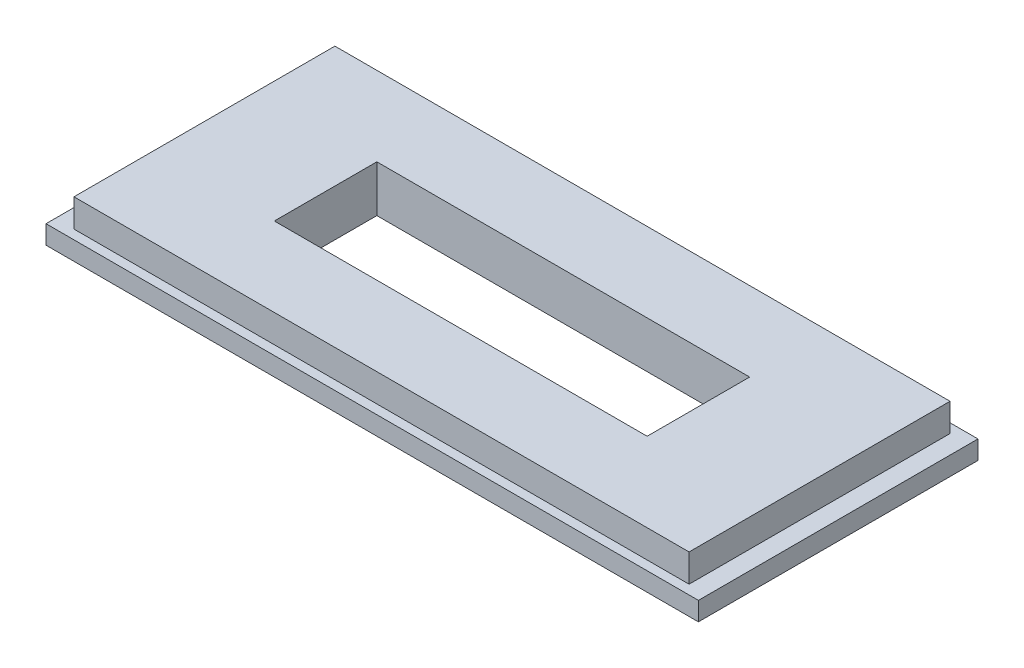
from build123d import *

# Parameters (mm, degrees)
SKETCH1_W           = 70
SKETCH1_H           = 30
BOSS_EXTRUDE1_DEPTH = 2
SKETCH2_W           = 66
SKETCH2_H           = 28
BOSS_EXTRUDE2_DEPTH = 3
SKETCH3_W           = 40
SKETCH3_H           = 11
CUT_EXTRUDE1_DEPTH  = 5
SKETCH4_W           = 0.366346154
SKETCH4_H           = 2.320192307
SKETCH4_W_2         = 0.366346153
SKETCH4_H_2         = 3.256410256
CUT_EXTRUDE2_DEPTH  = 2


with BuildPart() as part:
    # Sketch1 → Boss-Extrude1 (new body)
    with BuildSketch(Plane(origin=(0, 0, 0), x_dir=(1, 0, 0), z_dir=(0, 1, 0))):
        Rectangle(SKETCH1_W, SKETCH1_H)
    extrude(amount=BOSS_EXTRUDE1_DEPTH)

    # Sketch2 → Boss-Extrude2 (add)
    with BuildSketch(Plane(origin=(0, 2, 0), x_dir=(1, 0, 0), z_dir=(0, 1, 0))):
        Rectangle(SKETCH2_W, SKETCH2_H)
    extrude(amount=BOSS_EXTRUDE2_DEPTH)

    # Sketch3 → Cut-Extrude1 (cut)
    with BuildSketch(Plane(origin=(0, 5, 0), x_dir=(1, 0, 0), z_dir=(0, 1, 0))):
        Rectangle(SKETCH3_W, SKETCH3_H)
    extrude(amount=-CUT_EXTRUDE1_DEPTH, mode=Mode.SUBTRACT)

    # Sketch4 → Cut-Extrude2 (cut)
    # profile 1 of 24: a face of its own
    with BuildSketch(Plane(origin=(0, 0, 0), x_dir=(-1, 0, 0), z_dir=(0, -1, 0))):
        Polygon((-26.006678239, 12.049974099), (-25.626339697, 12.049974099), (-24.846582085, 9.76476276), (-23.729099112, 12.049974099), (-23.671221508, 12.049974099), (-22.567094906, 9.770486919), (-21.783521188, 12.049974099), (-21.406998752, 12.049974099), (-22.498405002, 8.874974099), (-22.543562253, 8.874974099), (-23.706838495, 11.276576663), (-24.882199072, 8.874974099), (-24.922904201, 8.874974099), align=None)
    # profile 2 of 24: a face of its own
    with BuildSketch(Plane(origin=(0, 0, 0), x_dir=(-1, 0, 0), z_dir=(0, -1, 0))):
        with BuildLine():
            Line((-17.662126957, 11.195166406), (-17.662126957, 8.874974099))
            Line((-17.662126957, 8.874974099), (-18.028473111, 8.874974099))
            Line((-18.028473111, 8.874974099), (-18.028473111, 9.276301222))
            add(Edge.make_bspline(
                [(-18.028473111, 9.276301222), (-18.06864869, 9.239781163), (-18.148030603, 9.167622103), (-18.278987129, 9.076049124), (-18.416443143, 8.998841824), (-18.561514002, 8.937911318), (-18.713521771, 8.891227454), (-18.872228835, 8.858786329), (-19.037884649, 8.837355347), (-19.150763161, 8.835310844), (-19.208285811, 8.83426897)],
                knots=[0, 0, 0, 0, 1.007002587, 1.989710968, 2.958714459, 3.92867649, 4.904631868, 5.90571095, 6.932754748, 8, 8, 8, 8], degree=3))
            add(Edge.make_bspline(
                [(-19.208285811, 8.83426897), (-19.259424077, 8.835381704), (-19.360064553, 8.837571573), (-19.507884344, 8.85444842), (-19.649945055, 8.881821125), (-19.786523003, 8.91976182), (-19.917312873, 8.969679837), (-20.042453294, 9.030306202), (-20.162056621, 9.101759157), (-20.274071965, 9.183973899), (-20.377073445, 9.273113301), (-20.467625751, 9.368223291), (-20.544041296, 9.468557415), (-20.606072978, 9.574182729), (-20.654789764, 9.684289048), (-20.69031698, 9.798981939), (-20.710887041, 9.918785481), (-20.713625809, 10.000224083), (-20.715011572, 10.041430429)],
                knots=[0, 0, 0, 0, 1.145830793, 2.255003245, 3.329367277, 4.385325446, 5.427436466, 6.462287268, 7.497923056, 8.545166036, 9.572265858, 10.546916581, 11.482909676, 12.392284641, 13.285707276, 14.175407987, 15.076791991, 16, 16, 16, 16], degree=3))
            add(Edge.make_bspline(
                [(-20.715011572, 10.041430429), (-20.713706903, 10.081808178), (-20.711120751, 10.161846082), (-20.689252052, 10.279247094), (-20.655006061, 10.392680707), (-20.605423389, 10.500926835), (-20.542647877, 10.605169172), (-20.464580273, 10.703718911), (-20.374121727, 10.798977625), (-20.270136799, 10.887661993), (-20.156841858, 10.968778516), (-20.036609725, 11.040649918), (-19.910588616, 11.101148098), (-19.778634014, 11.150037924), (-19.641605911, 11.18924805), (-19.49856259, 11.216394353), (-19.349847385, 11.23237961), (-19.248818174, 11.234694878), (-19.197473511, 11.235871535)],
                knots=[0, 0, 0, 0, 0.905211605, 1.794335776, 2.669961464, 3.557608684, 4.458147341, 5.393411987, 6.372391267, 7.401084961, 8.454378823, 9.495217074, 10.539754543, 11.585763711, 12.648731859, 13.733597461, 14.848177945, 16, 16, 16, 16], degree=3))
            add(Edge.make_bspline(
                [(-19.197473511, 11.235871535), (-19.138475777, 11.234570706), (-19.023059556, 11.232025917), (-18.854330385, 11.210870419), (-18.694563545, 11.174982962), (-18.567614629, 11.134238187), (-18.470769561, 11.09415149), (-18.400680421, 11.059711662), (-18.332787969, 11.020933924), (-18.267153252, 10.978267182), (-18.203852185, 10.931564589), (-18.142755462, 10.88075363), (-18.084196694, 10.825240625), (-18.047149346, 10.785758272), (-18.028473111, 10.765854507)],
                knots=[0, 0, 0, 0, 1.633418274, 3.195427233, 4.699552323, 6.162577194, 6.881098773, 7.600531238, 8.323643445, 9.04503759, 9.767195822, 10.500860824, 11.244256959, 12, 12, 12, 12], degree=3))
            Line((-18.028473111, 10.765854507), (-18.028473111, 11.195166406))
            Line((-18.028473111, 11.195166406), (-17.662126957, 11.195166406))
        make_face()
        with BuildLine():
            add(Edge.make_bspline(
                [(-19.187297229, 10.950935637), (-19.238682457, 10.949455615), (-19.340035563, 10.946536394), (-19.4891308, 10.923764135), (-19.632183834, 10.886209096), (-19.767884562, 10.834296133), (-19.894118378, 10.769351865), (-20.007344604, 10.690503725), (-20.107944167, 10.600188131), (-20.179573551, 10.514698338), (-20.228588321, 10.441993271), (-20.260693171, 10.38676734), (-20.288494152, 10.330964891), (-20.309645728, 10.273571577), (-20.327140871, 10.215862607), (-20.340128452, 10.157465887), (-20.34699209, 10.097989686), (-20.348106778, 10.058194319), (-20.348665418, 10.038250341)],
                knots=[0, 0, 0, 0, 1.507851667, 2.974112515, 4.41564081, 5.841814224, 7.23074732, 8.57209151, 9.880684575, 11.188226603, 11.833756132, 12.452826221, 13.062345153, 13.661062237, 14.245806186, 14.831708012, 15.414494903, 16, 16, 16, 16], degree=3))
            add(Edge.make_bspline(
                [(-20.348665418, 10.038250341), (-20.348180483, 10.018508231), (-20.347207045, 9.978878731), (-20.339176489, 9.919996093), (-20.327120765, 9.861475764), (-20.310055384, 9.803743873), (-20.287335471, 9.746691356), (-20.260284213, 9.690143505), (-20.227162195, 9.634732494), (-20.178569549, 9.56084014), (-20.105698936, 9.475147814), (-20.005088159, 9.383363739), (-19.89076404, 9.30406041), (-19.764283788, 9.237948493), (-19.629002447, 9.184446321), (-19.486715394, 9.147357857), (-19.339902303, 9.123429771), (-19.240180057, 9.120622134), (-19.1898413, 9.119204868)],
                knots=[0, 0, 0, 0, 0.57949018, 1.163244804, 1.741965386, 2.332879268, 2.928236174, 3.543567576, 4.171368968, 4.822294746, 6.139064333, 7.461091678, 8.81157044, 10.212281651, 11.64345589, 13.073451711, 14.522708737, 16, 16, 16, 16], degree=3))
            add(Edge.make_bspline(
                [(-19.1898413, 9.119204868), (-19.138879799, 9.120693869), (-19.037950521, 9.123642836), (-18.888687695, 9.14657878), (-18.743557785, 9.184237262), (-18.62656751, 9.227987848), (-18.537331162, 9.270244511), (-18.47365174, 9.30407143), (-18.414118222, 9.340752224), (-18.358626736, 9.380226436), (-18.307267638, 9.422390636), (-18.260519806, 9.467670529), (-18.216690974, 9.514837523), (-18.177527349, 9.564956809), (-18.142435046, 9.617232967), (-18.111645348, 9.671280484), (-18.086376378, 9.727447709), (-18.065322414, 9.784829099), (-18.048435944, 9.843628118), (-18.037276062, 9.904352), (-18.030038495, 9.966630374), (-18.028997463, 10.008761352), (-18.028473111, 10.029982111)],
                knots=[0, 0, 0, 0, 1.862528734, 3.688739127, 5.506640726, 7.336400479, 8.244805844, 9.115182216, 9.971292008, 10.799328464, 11.603178334, 12.3980472, 13.176998374, 13.955370903, 14.720667152, 15.477279131, 16.22651052, 16.969501729, 17.710509303, 18.459941124, 19.224294792, 20, 20, 20, 20], degree=3))
            add(Edge.make_bspline(
                [(-18.028473111, 10.029982111), (-18.029355225, 10.0620682), (-18.031095697, 10.125376247), (-18.047804891, 10.218165263), (-18.07350699, 10.307208654), (-18.111058289, 10.391791198), (-18.158497186, 10.47238325), (-18.216022831, 10.549234559), (-18.284897968, 10.621350989), (-18.363122889, 10.688515301), (-18.448733819, 10.749909631), (-18.539706424, 10.804394551), (-18.636206151, 10.849467898), (-18.737184812, 10.886224947), (-18.842687184, 10.916165957), (-18.953534249, 10.935620655), (-19.068872348, 10.949219713), (-19.147398447, 10.950357521), (-19.187297229, 10.950935637)],
                knots=[0, 0, 0, 0, 0.934434866, 1.843703859, 2.739261944, 3.630245698, 4.533235222, 5.460181769, 6.421866164, 7.43398917, 8.461260833, 9.48927571, 10.520406241, 11.560497361, 12.619021795, 13.71231236, 14.837635478, 16, 16, 16, 16], degree=3))
        make_face(mode=Mode.SUBTRACT)
    # profile 3 of 24: a face of its own
    with BuildSketch(Plane(origin=(0, 0, 0), x_dir=(-1, 0, 0), z_dir=(0, -1, 0))):
        with BuildLine():
            Line((-17.010844906, 11.195166406), (-16.644498752, 11.195166406))
            Line((-16.644498752, 11.195166406), (-16.644498752, 10.85362494))
            add(Edge.make_bspline(
                [(-16.644498752, 10.85362494), (-16.616875531, 10.88553425), (-16.563514743, 10.947174636), (-16.476700972, 11.028031722), (-16.387044969, 11.093994071), (-16.295425558, 11.147101913), (-16.201224066, 11.186181908), (-16.105784204, 11.215688465), (-16.007795377, 11.232367346), (-15.941758036, 11.23470081), (-15.908626356, 11.235871535)],
                knots=[0, 0, 0, 0, 1.179431667, 2.278351423, 3.308575639, 4.285660701, 5.231316452, 6.153897302, 7.073789434, 8, 8, 8, 8], degree=3))
            add(Edge.make_bspline(
                [(-15.908626356, 11.235871535), (-15.88290655, 11.234813462), (-15.830438085, 11.232654991), (-15.750680029, 11.217016489), (-15.668293247, 11.192379729), (-15.614134539, 11.168632886), (-15.586165418, 11.156369331)],
                knots=[0, 0, 0, 0, 0.92203962, 1.880962996, 2.905668111, 4, 4, 4, 4], degree=3))
            Line((-15.586165418, 11.156369331), (-15.780150795, 10.909594491))
            add(Edge.make_bspline(
                [(-15.780150795, 10.909594491), (-15.798324344, 10.915719329), (-15.832923306, 10.92737985), (-15.882900383, 10.941007225), (-15.92870572, 10.949236819), (-15.957783209, 10.950388638), (-15.971592101, 10.950935637)],
                knots=[0, 0, 0, 0, 1.169588779, 2.226673454, 3.157847626, 4, 4, 4, 4], degree=3))
            add(Edge.make_bspline(
                [(-15.971592101, 10.950935637), (-16.001627074, 10.949449957), (-16.062137749, 10.946456795), (-16.151565, 10.922295703), (-16.239032189, 10.883349145), (-16.309052004, 10.839353232), (-16.362980444, 10.796861995), (-16.400986023, 10.759707303), (-16.436971006, 10.718849991), (-16.469919589, 10.673230901), (-16.501198972, 10.623973226), (-16.528971347, 10.569842935), (-16.555383747, 10.51236578), (-16.569762322, 10.471716093), (-16.577080883, 10.451025781)],
                knots=[0, 0, 0, 0, 1.286020741, 2.590912373, 3.941797877, 5.379059802, 6.122766786, 6.881154157, 7.653996519, 8.453779985, 9.290899823, 10.152666824, 11.05972466, 12, 12, 12, 12], degree=3))
            add(Edge.make_bspline(
                [(-16.577080883, 10.451025781), (-16.582733879, 10.4326683), (-16.595196475, 10.392197391), (-16.607223074, 10.323598911), (-16.619999003, 10.242953097), (-16.627727216, 10.149397311), (-16.635936881, 10.043661125), (-16.640450578, 9.925280517), (-16.643743671, 9.794250822), (-16.644239429, 9.702647818), (-16.644498752, 9.654731711)],
                knots=[0, 0, 0, 0, 0.574590964, 1.26674338, 2.081862612, 3.019184713, 4.075638968, 5.257387554, 6.565382064, 8, 8, 8, 8], degree=3))
            Line((-16.644498752, 9.654731711), (-16.644498752, 8.874974099))
            Line((-16.644498752, 8.874974099), (-17.010844906, 8.874974099))
            Line((-17.010844906, 8.874974099), (-17.010844906, 11.195166406))
        make_face()
    # profile 4 of 24: a face of its own
    with BuildSketch(Plane(origin=(0, 0, 0), x_dir=(-1, 0, 0), z_dir=(0, -1, 0))):
        with BuildLine():
            Line((-15.260524393, 11.195166406), (-14.894178239, 11.195166406))
            Line((-14.894178239, 11.195166406), (-14.894178239, 10.776666807))
            add(Edge.make_bspline(
                [(-14.894178239, 10.776666807), (-14.856549998, 10.814778869), (-14.782749181, 10.889528613), (-14.661194484, 10.986199579), (-14.533084527, 11.065496502), (-14.399122501, 11.129191363), (-14.258834389, 11.176543518), (-14.113248218, 11.211109592), (-13.961524871, 11.231846385), (-13.858381819, 11.234515015), (-13.805952077, 11.235871535)],
                knots=[0, 0, 0, 0, 1.055261007, 2.069698788, 3.053313176, 4.019960162, 4.987546553, 5.96692435, 6.966545693, 8, 8, 8, 8], degree=3))
            add(Edge.make_bspline(
                [(-13.805952077, 11.235871535), (-13.77922479, 11.235576736), (-13.726539268, 11.234995623), (-13.648642912, 11.228233637), (-13.573051976, 11.218217831), (-13.499506927, 11.204281684), (-13.428288762, 11.18592969), (-13.359543134, 11.16290735), (-13.293124157, 11.136018384), (-13.228999835, 11.105788782), (-13.168383108, 11.071523292), (-13.111268639, 11.034579473), (-13.05858661, 10.994325932), (-13.009240222, 10.951894247), (-12.964775953, 10.905945455), (-12.924362398, 10.857258135), (-12.888167259, 10.805817285), (-12.855701705, 10.750897648), (-12.827279117, 10.690496407), (-12.802582313, 10.623311623), (-12.782639114, 10.548032884), (-12.765221, 10.465530179), (-12.753173188, 10.374914711), (-12.743461064, 10.276720318), (-12.737843851, 10.170818993), (-12.737159372, 10.097618326), (-12.736806444, 10.05987494)],
                knots=[0, 0, 0, 0, 1.053272337, 2.07623775, 3.079661827, 4.058137329, 5.024980994, 5.97635125, 6.913670182, 7.848190862, 8.768668557, 9.656433212, 10.527240363, 11.380221142, 12.2194173, 13.044386986, 13.872103408, 14.696226102, 15.556016319, 16.499906235, 17.513578785, 18.623164628, 19.82156205, 21.114620664, 22.512254163, 24, 24, 24, 24], degree=3))
            Line((-12.736806444, 10.05987494), (-12.736806444, 8.874974099))
            Line((-12.736806444, 8.874974099), (-13.103152598, 8.874974099))
            Line((-13.103152598, 8.874974099), (-13.103152598, 9.966380349))
            add(Edge.make_bspline(
                [(-13.103152598, 9.966380349), (-13.103234854, 9.997971479), (-13.103392206, 10.058403831), (-13.105656903, 10.144892528), (-13.107544977, 10.223397421), (-13.112495127, 10.293528961), (-13.11682526, 10.355583959), (-13.124362546, 10.409131174), (-13.131112356, 10.454770576), (-13.13814886, 10.48201935), (-13.141313656, 10.49427498)],
                knots=[0, 0, 0, 0, 1.429241887, 2.734072782, 3.914513891, 4.981342211, 5.91492633, 6.727534453, 7.427685584, 8, 8, 8, 8], degree=3))
            add(Edge.make_bspline(
                [(-13.141313656, 10.49427498), (-13.146447356, 10.512843299), (-13.156526052, 10.549297401), (-13.177835219, 10.600927634), (-13.203006867, 10.649060644), (-13.231110271, 10.69422963), (-13.264197201, 10.735186088), (-13.300362997, 10.773184373), (-13.341552103, 10.806702307), (-13.386013128, 10.83751586), (-13.434675167, 10.863910883), (-13.486337825, 10.887801784), (-13.541755145, 10.907326113), (-13.600899217, 10.923236643), (-13.663348134, 10.935831276), (-13.729412255, 10.944765744), (-13.798878814, 10.949730775), (-13.846437473, 10.950527216), (-13.870825875, 10.950935637)],
                knots=[0, 0, 0, 0, 0.987272075, 1.938253952, 2.857375671, 3.771338092, 4.661116111, 5.553083661, 6.456573691, 7.379417866, 8.323537862, 9.29176693, 10.295957268, 11.33252951, 12.430682622, 13.560878994, 14.749202259, 16, 16, 16, 16], degree=3))
            add(Edge.make_bspline(
                [(-13.870825875, 10.950935637), (-13.899042355, 10.95050386), (-13.954752884, 10.94965136), (-14.037244444, 10.941145915), (-14.117281743, 10.927021738), (-14.195546686, 10.908307745), (-14.270838658, 10.882290722), (-14.344827265, 10.852759076), (-14.415743533, 10.81615536), (-14.484287755, 10.775118235), (-14.548298735, 10.729793914), (-14.607512782, 10.681715505), (-14.661005807, 10.631166461), (-14.708167078, 10.57714196), (-14.750588007, 10.521468917), (-14.786189246, 10.46214718), (-14.817175395, 10.400945275), (-14.832499295, 10.357926875), (-14.840116741, 10.336542608)],
                knots=[0, 0, 0, 0, 1.107591695, 2.186825604, 3.251516094, 4.297295924, 5.342313536, 6.376433621, 7.42251156, 8.471764048, 9.511030537, 10.499064355, 11.464647586, 12.396488807, 13.312128077, 14.2086496, 15.109527217, 16, 16, 16, 16], degree=3))
            add(Edge.make_bspline(
                [(-14.840116741, 10.336542608), (-14.84460919, 10.320914268), (-14.854354323, 10.287012886), (-14.864334174, 10.230924634), (-14.874175765, 10.1662998), (-14.881465616, 10.092838328), (-14.886956866, 10.010527587), (-14.891511967, 9.919570316), (-14.893978808, 9.819686233), (-14.894109904, 9.750135629), (-14.894178239, 9.71388135)],
                knots=[0, 0, 0, 0, 0.622233357, 1.349763981, 2.178605038, 3.125238494, 4.174917485, 5.337083416, 6.611915413, 8, 8, 8, 8], degree=3))
            Line((-14.894178239, 9.71388135), (-14.894178239, 8.874974099))
            Line((-14.894178239, 8.874974099), (-15.260524393, 8.874974099))
            Line((-15.260524393, 8.874974099), (-15.260524393, 11.195166406))
        make_face()
    # profile 5 of 24: a face of its own
    with BuildSketch(Plane(origin=(0, 0, 0), x_dir=(-1, 0, 0), z_dir=(0, -1, 0))):
        with BuildLine():
            add(Edge.make_bspline(
                [(-11.781507967, 12.172089483), (-11.761086964, 12.17126363), (-11.721265618, 12.169653201), (-11.663788283, 12.156228014), (-11.611575029, 12.132683498), (-11.564835867, 12.101879817), (-11.525217144, 12.064846901), (-11.495819741, 12.02253238), (-11.478245405, 11.975582543), (-11.4760559, 11.943054109), (-11.47494747, 11.926586679)],
                knots=[0, 0, 0, 0, 1.126292746, 2.196292449, 3.23347918, 4.271985151, 5.273442343, 6.208143861, 7.092877767, 8, 8, 8, 8], degree=3))
            add(Edge.make_bspline(
                [(-11.47494747, 11.926586679), (-11.476079168, 11.91054642), (-11.478329599, 11.87864968), (-11.495821462, 11.832497058), (-11.525435756, 11.790817206), (-11.564809878, 11.753818372), (-11.611582079, 11.723039149), (-11.663786341, 11.699487976), (-11.72126614, 11.686064613), (-11.761087141, 11.684453929), (-11.781507967, 11.683627945)],
                knots=[0, 0, 0, 0, 0.888755228, 1.767327854, 2.697484928, 3.7044632, 4.748694502, 5.79159929, 6.86749795, 8, 8, 8, 8], degree=3))
            add(Edge.make_bspline(
                [(-11.781507967, 11.683627945), (-11.801507142, 11.684460744), (-11.840701521, 11.686092864), (-11.897498348, 11.699612621), (-11.949542178, 11.723019599), (-11.996245201, 11.75385687), (-12.035765161, 11.790609691), (-12.064554027, 11.83270688), (-12.082176867, 11.878625836), (-12.084404273, 11.910538442), (-12.085524393, 11.926586679)],
                knots=[0, 0, 0, 0, 1.114826149, 2.184835993, 3.233187219, 4.282871886, 5.295108974, 6.223442501, 7.10660336, 8, 8, 8, 8], degree=3))
            add(Edge.make_bspline(
                [(-12.085524393, 11.926586679), (-12.084427957, 11.943062248), (-12.082262147, 11.975606759), (-12.0645528, 12.022323741), (-12.035984258, 12.065051445), (-11.996219481, 12.101842027), (-11.949549158, 12.132702858), (-11.897496447, 12.156103437), (-11.840702024, 12.169624926), (-11.801507312, 12.171256806), (-11.781507967, 12.172089483)],
                knots=[0, 0, 0, 0, 0.911825585, 1.801146763, 2.734119375, 3.740769039, 4.784659576, 5.827224033, 6.891327554, 8, 8, 8, 8], degree=3))
        make_face()
    # profile 6 of 24: a face of its own
    with BuildSketch(Plane(origin=(0, 0, 0), x_dir=(-1, 0, 0), z_dir=(0, -1, 0))):
        with Locations((-11.780235931, 10.035070253)):
            Rectangle(SKETCH4_W, SKETCH4_H)
    # profile 7 of 24: a face of its own
    with BuildSketch(Plane(origin=(0, 0, 0), x_dir=(-1, 0, 0), z_dir=(0, -1, 0))):
        with BuildLine():
            Line((-10.823665418, 11.195166406), (-10.457319265, 11.195166406))
            Line((-10.457319265, 11.195166406), (-10.457319265, 10.776666807))
            add(Edge.make_bspline(
                [(-10.457319265, 10.776666807), (-10.419691024, 10.814778869), (-10.345890207, 10.889528613), (-10.224335509, 10.986199579), (-10.096225553, 11.065496502), (-9.962263527, 11.129191363), (-9.821975415, 11.176543518), (-9.676389244, 11.211109592), (-9.524665897, 11.231846385), (-9.421522845, 11.234515015), (-9.369093103, 11.235871535)],
                knots=[0, 0, 0, 0, 1.055261007, 2.069698788, 3.053313176, 4.019960162, 4.987546553, 5.96692435, 6.966545693, 8, 8, 8, 8], degree=3))
            add(Edge.make_bspline(
                [(-9.369093103, 11.235871535), (-9.342365816, 11.235576736), (-9.289680294, 11.234995623), (-9.211783938, 11.228233637), (-9.136193001, 11.218217831), (-9.062647952, 11.204281684), (-8.991429788, 11.18592969), (-8.922684159, 11.16290735), (-8.856265182, 11.136018384), (-8.79214086, 11.105788782), (-8.731524133, 11.071523292), (-8.674409665, 11.034579473), (-8.621727635, 10.994325932), (-8.572381248, 10.951894247), (-8.527916978, 10.905945455), (-8.487503423, 10.857258135), (-8.451308284, 10.805817285), (-8.418842731, 10.750897648), (-8.390420143, 10.690496407), (-8.365723339, 10.623311623), (-8.34578014, 10.548032884), (-8.328362026, 10.465530179), (-8.316314214, 10.374914711), (-8.306602089, 10.276720318), (-8.300984877, 10.170818993), (-8.300300398, 10.097618326), (-8.29994747, 10.05987494)],
                knots=[0, 0, 0, 0, 1.053272337, 2.07623775, 3.079661827, 4.058137329, 5.024980994, 5.97635125, 6.913670182, 7.848190862, 8.768668557, 9.656433212, 10.527240363, 11.380221142, 12.2194173, 13.044386986, 13.872103408, 14.696226102, 15.556016319, 16.499906235, 17.513578785, 18.623164628, 19.82156205, 21.114620664, 22.512254163, 24, 24, 24, 24], degree=3))
            Line((-8.29994747, 10.05987494), (-8.29994747, 8.874974099))
            Line((-8.29994747, 8.874974099), (-8.666293624, 8.874974099))
            Line((-8.666293624, 8.874974099), (-8.666293624, 9.966380349))
            add(Edge.make_bspline(
                [(-8.666293624, 9.966380349), (-8.66637588, 9.997971479), (-8.666533232, 10.058403831), (-8.668797929, 10.144892528), (-8.670686002, 10.223397421), (-8.675636153, 10.293528961), (-8.679966286, 10.355583959), (-8.687503572, 10.409131174), (-8.694253381, 10.454770576), (-8.701289886, 10.48201935), (-8.704454681, 10.49427498)],
                knots=[0, 0, 0, 0, 1.429241887, 2.734072782, 3.914513891, 4.981342211, 5.91492633, 6.727534453, 7.427685584, 8, 8, 8, 8], degree=3))
            add(Edge.make_bspline(
                [(-8.704454681, 10.49427498), (-8.709588382, 10.512843299), (-8.719667078, 10.549297401), (-8.740976245, 10.600927634), (-8.766147893, 10.649060644), (-8.794251297, 10.69422963), (-8.827338227, 10.735186088), (-8.863504023, 10.773184373), (-8.904693129, 10.806702307), (-8.949154153, 10.83751586), (-8.997816193, 10.863910883), (-9.049478851, 10.887801784), (-9.104896171, 10.907326113), (-9.164040243, 10.923236643), (-9.226489159, 10.935831276), (-9.29255328, 10.944765744), (-9.36201984, 10.949730775), (-9.409578499, 10.950527216), (-9.433966901, 10.950935637)],
                knots=[0, 0, 0, 0, 0.987272075, 1.938253952, 2.857375671, 3.771338092, 4.661116111, 5.553083661, 6.456573691, 7.379417866, 8.323537862, 9.29176693, 10.295957268, 11.33252951, 12.430682622, 13.560878994, 14.749202259, 16, 16, 16, 16], degree=3))
            add(Edge.make_bspline(
                [(-9.433966901, 10.950935637), (-9.46218338, 10.95050386), (-9.51789391, 10.94965136), (-9.60038547, 10.941145915), (-9.680422768, 10.927021738), (-9.758687712, 10.908307745), (-9.833979684, 10.882290722), (-9.907968291, 10.852759076), (-9.978884559, 10.81615536), (-10.047428781, 10.775118235), (-10.111439761, 10.729793914), (-10.170653808, 10.681715505), (-10.224146833, 10.631166461), (-10.271308104, 10.57714196), (-10.313729032, 10.521468917), (-10.349330271, 10.46214718), (-10.380316421, 10.400945275), (-10.39564032, 10.357926875), (-10.403257766, 10.336542608)],
                knots=[0, 0, 0, 0, 1.107591695, 2.186825604, 3.251516094, 4.297295924, 5.342313536, 6.376433621, 7.42251156, 8.471764048, 9.511030537, 10.499064355, 11.464647586, 12.396488807, 13.312128077, 14.2086496, 15.109527217, 16, 16, 16, 16], degree=3))
            add(Edge.make_bspline(
                [(-10.403257766, 10.336542608), (-10.407750216, 10.320914268), (-10.417495349, 10.287012886), (-10.4274752, 10.230924634), (-10.43731679, 10.1662998), (-10.444606642, 10.092838328), (-10.450097892, 10.010527587), (-10.454652993, 9.919570316), (-10.457119834, 9.819686233), (-10.457250929, 9.750135629), (-10.457319265, 9.71388135)],
                knots=[0, 0, 0, 0, 0.622233357, 1.349763981, 2.178605038, 3.125238494, 4.174917485, 5.337083416, 6.611915413, 8, 8, 8, 8], degree=3))
            Line((-10.457319265, 9.71388135), (-10.457319265, 8.874974099))
            Line((-10.457319265, 8.874974099), (-10.823665418, 8.874974099))
            Line((-10.823665418, 8.874974099), (-10.823665418, 11.195166406))
        make_face()
    # profile 8 of 24: a face of its own
    with BuildSketch(Plane(origin=(0, 0, 0), x_dir=(-1, 0, 0), z_dir=(0, -1, 0))):
        with BuildLine():
            Line((-5.002832085, 11.195166406), (-4.636485931, 11.195166406))
            Line((-4.636485931, 11.195166406), (-4.636485931, 9.353895373))
            add(Edge.make_bspline(
                [(-4.636485931, 9.353895373), (-4.636952141, 9.314671606), (-4.6378521, 9.238954947), (-4.641900217, 9.129462341), (-4.65019061, 9.028258509), (-4.661633053, 8.93511993), (-4.675553733, 8.849984021), (-4.694622133, 8.77336526), (-4.714481893, 8.704137628), (-4.732735351, 8.66217635), (-4.74142884, 8.642191647)],
                knots=[0, 0, 0, 0, 1.299739332, 2.508986973, 3.629640421, 4.663010938, 5.618085253, 6.485315007, 7.278608, 8, 8, 8, 8], degree=3))
            add(Edge.make_bspline(
                [(-4.74142884, 8.642191647), (-4.75406261, 8.61604884), (-4.77914394, 8.564148548), (-4.825703176, 8.491415326), (-4.877947043, 8.422835432), (-4.937463928, 8.359023729), (-5.003859054, 8.299880761), (-5.07668016, 8.245124962), (-5.155775598, 8.194522959), (-5.241604873, 8.149901769), (-5.33272821, 8.109668725), (-5.428696132, 8.075126349), (-5.528877927, 8.044509226), (-5.633956708, 8.021951011), (-5.743084586, 8.002165222), (-5.856980066, 7.989425408), (-5.975376706, 7.980659053), (-6.055848201, 7.97986513), (-6.096782406, 7.979461278)],
                knots=[0, 0, 0, 0, 0.872974144, 1.733081416, 2.593023085, 3.464154057, 4.354139461, 5.265070691, 6.202963901, 7.175972195, 8.172778382, 9.197920917, 10.243345035, 11.322026303, 12.429502775, 13.579183, 14.768579886, 16, 16, 16, 16], degree=3))
            add(Edge.make_bspline(
                [(-6.096782406, 7.979461278), (-6.156404348, 7.980239546), (-6.272711566, 7.98175775), (-6.442152383, 7.999316875), (-6.602689707, 8.024378576), (-6.752692584, 8.061994679), (-6.891230103, 8.10821978), (-7.017158026, 8.161432642), (-7.129964928, 8.221767179), (-7.231349255, 8.290969625), (-7.32287036, 8.373767381), (-7.40979084, 8.470566432), (-7.49258167, 8.584351478), (-7.541710858, 8.668435048), (-7.567255162, 8.712153586)],
                knots=[0, 0, 0, 0, 1.235299662, 2.409754916, 3.527343071, 4.600579225, 5.610819996, 6.551909152, 7.430780881, 8.258427892, 9.089369694, 9.982365301, 10.950947993, 12, 12, 12, 12], degree=3))
            Line((-7.567255162, 8.712153586), (-7.200909008, 8.712153586))
            add(Edge.make_bspline(
                [(-7.200909008, 8.712153586), (-7.186985999, 8.693480453), (-7.159321875, 8.656378139), (-7.11315577, 8.605151391), (-7.064849218, 8.556722073), (-7.012373039, 8.51352011), (-6.958303003, 8.471955517), (-6.900335411, 8.435496575), (-6.839693314, 8.402145124), (-6.77575532, 8.372706377), (-6.708207172, 8.347559094), (-6.637139425, 8.325091488), (-6.562216462, 8.305997402), (-6.483144382, 8.291036537), (-6.400427438, 8.278732179), (-6.31357576, 8.270790159), (-6.222989444, 8.265578075), (-6.161239731, 8.264795116), (-6.129855322, 8.264397176)],
                knots=[0, 0, 0, 0, 0.923828755, 1.835588359, 2.733896446, 3.635507725, 4.530658581, 5.438528408, 6.349666764, 7.275714701, 8.228881026, 9.208053896, 10.232375988, 11.294955423, 12.400272329, 13.549663438, 14.754611774, 16, 16, 16, 16], degree=3))
            add(Edge.make_bspline(
                [(-6.129855322, 8.264397176), (-6.098682324, 8.264784594), (-6.037778515, 8.265541506), (-5.94825713, 8.270846616), (-5.862461793, 8.27872975), (-5.780376516, 8.291022742), (-5.701751406, 8.306081115), (-5.627019856, 8.325080839), (-5.55596261, 8.347570636), (-5.488647281, 8.372573845), (-5.426021085, 8.401576667), (-5.367186103, 8.43122979), (-5.313127304, 8.462934792), (-5.263852165, 8.49653269), (-5.219963375, 8.532668183), (-5.179520615, 8.569137533), (-5.144390181, 8.608146736), (-5.113637357, 8.649736247), (-5.087231425, 8.695821657), (-5.064153725, 8.747724228), (-5.045486157, 8.806706295), (-5.029556278, 8.87212662), (-5.017842137, 8.944458021), (-5.008853816, 9.023396224), (-5.00403026, 9.109180962), (-5.003240674, 9.168596932), (-5.002832085, 9.199343089)],
                knots=[0, 0, 0, 0, 1.324975034, 2.588651425, 3.810839467, 4.985872145, 6.11519706, 7.212389084, 8.261219986, 9.282194246, 10.262178001, 11.193164094, 12.081842738, 12.924218688, 13.725031491, 14.496717776, 15.236873509, 15.952427625, 16.691265572, 17.490047657, 18.362076081, 19.317216335, 20.349816766, 21.47434959, 22.69304428, 24, 24, 24, 24], degree=3))
            Line((-5.002832085, 9.199343089), (-5.002832085, 9.319550421))
            add(Edge.make_bspline(
                [(-5.002832085, 9.319550421), (-5.038537092, 9.284965135), (-5.110217781, 9.215532377), (-5.232384835, 9.126650194), (-5.365395875, 9.049847655), (-5.509126473, 8.986787421), (-5.660344414, 8.93673549), (-5.81753427, 8.901163206), (-5.979106103, 8.878766559), (-6.088653372, 8.876244709), (-6.14384771, 8.874974099)],
                knots=[0, 0, 0, 0, 0.94780972, 1.902804645, 2.874490429, 3.874510598, 4.893073619, 5.910019789, 6.94698357, 8, 8, 8, 8], degree=3))
            add(Edge.make_bspline(
                [(-6.14384771, 8.874974099), (-6.176513915, 8.875436043), (-6.24130012, 8.876352208), (-6.337632618, 8.884514359), (-6.432384598, 8.89620649), (-6.525765292, 8.91366809), (-6.617778676, 8.935670403), (-6.708266014, 8.963398503), (-6.797402867, 8.994929543), (-6.884241967, 9.031732937), (-6.9677418, 9.073010787), (-7.047200597, 9.117157723), (-7.121564435, 9.165184702), (-7.190819361, 9.216855479), (-7.255842543, 9.271179583), (-7.315358662, 9.329649919), (-7.370094347, 9.391193767), (-7.419582257, 9.456196997), (-7.464302819, 9.523266405), (-7.502318859, 9.592852143), (-7.535056899, 9.663749478), (-7.561881589, 9.736203125), (-7.582260451, 9.810515246), (-7.596853714, 9.886424987), (-7.60601107, 9.964037868), (-7.607308273, 10.016389043), (-7.60796029, 10.042702464)],
                knots=[0, 0, 0, 0, 1.131135092, 2.243356722, 3.346256638, 4.436447048, 5.531694657, 6.621093533, 7.712643053, 8.805007226, 9.885361579, 10.93729654, 11.951553209, 12.948682134, 13.928301376, 14.883680584, 15.83552631, 16.778351757, 17.711058783, 18.624639263, 19.521573958, 20.413626602, 21.297177529, 22.187112358, 23.088783099, 24, 24, 24, 24], degree=3))
            add(Edge.make_bspline(
                [(-7.60796029, 10.042702464), (-7.607288737, 10.069013242), (-7.605947291, 10.1215698), (-7.596997779, 10.199677323), (-7.581633835, 10.276458165), (-7.559972064, 10.351790291), (-7.531653402, 10.425599668), (-7.498209118, 10.498387549), (-7.457412559, 10.569128752), (-7.412085441, 10.63897015), (-7.360671314, 10.706190406), (-7.303952424, 10.769799999), (-7.242531069, 10.829676197), (-7.177023822, 10.886610427), (-7.106279614, 10.939278416), (-7.030891498, 10.988219052), (-6.951282324, 11.034294099), (-6.867075809, 11.075965622), (-6.779768093, 11.112851032), (-6.691228598, 11.146736247), (-6.600827827, 11.173345676), (-6.509808494, 11.196956225), (-6.417247078, 11.213637861), (-6.323917426, 11.226547901), (-6.229209687, 11.234433753), (-6.16569896, 11.235389543), (-6.133671428, 11.235871535)],
                knots=[0, 0, 0, 0, 0.902100245, 1.80197192, 2.691538086, 3.584187678, 4.486024301, 5.399879929, 6.327651119, 7.283309052, 8.253045548, 9.226154484, 10.202813588, 11.192318718, 12.199816324, 13.2240367, 14.272627265, 15.351910403, 16.442880232, 17.521673677, 18.600173199, 19.672087454, 20.744223512, 21.822625043, 22.901981616, 24, 24, 24, 24], degree=3))
            add(Edge.make_bspline(
                [(-6.133671428, 11.235871535), (-6.081250621, 11.234637326), (-5.977776635, 11.232201108), (-5.825437511, 11.213251275), (-5.678303641, 11.182887021), (-5.535713264, 11.139533748), (-5.396380695, 11.080759944), (-5.261061205, 11.001963858), (-5.128006223, 10.904961539), (-5.045341431, 10.828636411), (-5.002832085, 10.78938716)],
                knots=[0, 0, 0, 0, 1.006520588, 1.986781657, 2.943436662, 3.888795489, 4.844722379, 5.840637478, 6.889574561, 8, 8, 8, 8], degree=3))
            Line((-5.002832085, 10.78938716), (-5.002832085, 11.195166406))
        make_face()
        with BuildLine():
            add(Edge.make_bspline(
                [(-6.097418423, 10.950935637), (-6.148398142, 10.94955643), (-6.248766563, 10.94684106), (-6.396371801, 10.922651726), (-6.538809004, 10.885991378), (-6.673570012, 10.831994891), (-6.799455488, 10.767131639), (-6.911707369, 10.688080483), (-7.010150279, 10.598044993), (-7.079311093, 10.512987543), (-7.126958135, 10.441105193), (-7.157541152, 10.385770238), (-7.182941236, 10.329215806), (-7.20493966, 10.272096151), (-7.221522501, 10.213333156), (-7.232721315, 10.153490124), (-7.240059877, 10.092704002), (-7.241093462, 10.051839758), (-7.241614136, 10.031254147)],
                knots=[0, 0, 0, 0, 1.500826197, 2.954813407, 4.395513548, 5.825546973, 7.222393888, 8.558347884, 9.857831362, 11.140561814, 11.776299279, 12.396884656, 13.000615528, 13.601496764, 14.198600883, 14.796357932, 15.393658005, 16, 16, 16, 16], degree=3))
            add(Edge.make_bspline(
                [(-7.241614136, 10.031254147), (-7.240632455, 10.00045002), (-7.238698367, 9.93976035), (-7.223488848, 9.850822888), (-7.199844173, 9.765771463), (-7.164536973, 9.685401013), (-7.120736936, 9.608805627), (-7.066615772, 9.536307477), (-7.002682992, 9.468246647), (-6.929554506, 9.4047846), (-6.848648477, 9.347604383), (-6.761735136, 9.296570023), (-6.668182372, 9.255100653), (-6.569524541, 9.219588188), (-6.464568643, 9.193450194), (-6.35437382, 9.173417586), (-6.238218002, 9.162043548), (-6.158923986, 9.160631508), (-6.118407005, 9.159909996)],
                knots=[0, 0, 0, 0, 0.930628694, 1.833505926, 2.719926814, 3.59252644, 4.479595703, 5.381904193, 6.320442429, 7.297063988, 8.303506575, 9.311417054, 10.338199175, 11.392178472, 12.477070552, 13.603379151, 14.775395104, 16, 16, 16, 16], degree=3))
            add(Edge.make_bspline(
                [(-6.118407005, 9.159909996), (-6.077461142, 9.160601305), (-5.997522445, 9.161950949), (-5.880624615, 9.173683184), (-5.769796203, 9.192456526), (-5.665120699, 9.219197028), (-5.566510128, 9.253271482), (-5.474691, 9.296462356), (-5.388289735, 9.345846403), (-5.308945761, 9.403151602), (-5.237052772, 9.466360205), (-5.174402678, 9.535338643), (-5.121235386, 9.608902882), (-5.077262494, 9.686992346), (-5.044403092, 9.770634469), (-5.01991253, 9.858577051), (-5.005945029, 9.951733169), (-5.003884733, 10.015308602), (-5.002832085, 10.047790605)],
                knots=[0, 0, 0, 0, 1.22791875, 2.397268453, 3.520095211, 4.596661188, 5.63443916, 6.644431651, 7.63591655, 8.615419319, 9.574984622, 10.502382042, 11.404268322, 12.292464563, 13.182843554, 14.093076058, 15.025713114, 16, 16, 16, 16], degree=3))
            add(Edge.make_bspline(
                [(-5.002832085, 10.047790605), (-5.003069701, 10.069226906), (-5.003539221, 10.111584174), (-5.011157938, 10.174003644), (-5.021675512, 10.234644941), (-5.036931229, 10.293670794), (-5.057553153, 10.350646947), (-5.081592815, 10.406304628), (-5.11035961, 10.459889579), (-5.154804817, 10.528782566), (-5.219819844, 10.61008883), (-5.313250338, 10.696826184), (-5.421749314, 10.771810619), (-5.542761917, 10.835469518), (-5.673210556, 10.886427643), (-5.809849235, 10.924597636), (-5.952136321, 10.946287842), (-6.048586491, 10.949373429), (-6.097418423, 10.950935637)],
                knots=[0, 0, 0, 0, 0.650145919, 1.284662208, 1.905625727, 2.517387288, 3.131984532, 3.742831827, 4.35597911, 4.975307063, 6.229375347, 7.504104155, 8.830324791, 10.220510108, 11.644748587, 13.07305077, 14.518109536, 16, 16, 16, 16], degree=3))
        make_face(mode=Mode.SUBTRACT)
    # profile 9 of 24: a face of its own
    with BuildSketch(Plane(origin=(0, 0, 0), x_dir=(-1, 0, 0), z_dir=(0, -1, 0))):
        with BuildLine():
            Line((1.387873043, 11.467381951), (1.079404493, 11.276576663))
            add(Edge.make_bspline(
                [(1.079404493, 11.276576663), (1.057805737, 11.29782014), (1.014659611, 11.340256554), (0.945682576, 11.399322611), (0.873706009, 11.45470695), (0.7986478, 11.50661864), (0.719626957, 11.553217349), (0.637918489, 11.596962588), (0.552803217, 11.6360319), (0.46479003, 11.671853025), (0.37415766, 11.703496643), (0.281008803, 11.731037805), (0.185582262, 11.753604374), (0.088268065, 11.772963901), (-0.011332261, 11.787357503), (-0.113140265, 11.798310674), (-0.217350007, 11.804786616), (-0.287600518, 11.805422683), (-0.323014377, 11.805743329)],
                knots=[0, 0, 0, 0, 0.944229843, 1.886213253, 2.828776153, 3.774739271, 4.729138496, 5.687101141, 6.662954288, 7.647275832, 8.648515628, 9.654456311, 10.674005539, 11.704486012, 12.746684532, 13.810126652, 14.896066901, 16, 16, 16, 16], degree=3))
            add(Edge.make_bspline(
                [(-0.323014377, 11.805743329), (-0.361832069, 11.805385747), (-0.43872584, 11.804677414), (-0.552872598, 11.795024998), (-0.664799346, 11.781452374), (-0.774579633, 11.76165327), (-0.882080991, 11.735927406), (-0.987915497, 11.705931994), (-1.090981494, 11.668421441), (-1.191824295, 11.626932459), (-1.28848097, 11.580237891), (-1.37985486, 11.529008629), (-1.465866462, 11.474525361), (-1.546210026, 11.415675278), (-1.621416148, 11.353693943), (-1.690546874, 11.286972632), (-1.753939506, 11.216503856), (-1.812007682, 11.142748063), (-1.863672755, 11.065881364), (-1.907952772, 10.986064539), (-1.946989582, 10.904480901), (-1.976891654, 10.819591749), (-2.001529379, 10.733011668), (-2.018404083, 10.643818446), (-2.029903101, 10.552454276), (-2.030870549, 10.490494862), (-2.031357726, 10.45929401)],
                knots=[0, 0, 0, 0, 1.155456698, 2.288838338, 3.408477866, 4.511715144, 5.607995751, 6.698792325, 7.784976321, 8.871692126, 9.944532353, 10.978871402, 11.989279694, 12.974104888, 13.942363502, 14.888812066, 15.831907597, 16.762583922, 17.681735799, 18.586093927, 19.478453884, 20.37101476, 21.262391794, 22.156224109, 23.071531282, 24, 24, 24, 24], degree=3))
            add(Edge.make_bspline(
                [(-2.031357726, 10.45929401), (-2.029934712, 10.412347855), (-2.027135468, 10.319998987), (-2.003658104, 10.184492532), (-1.964600185, 10.055448427), (-1.910692268, 9.931853368), (-1.8409264, 9.814467751), (-1.755399216, 9.703187611), (-1.654955298, 9.597922544), (-1.540109491, 9.49997491), (-1.413613577, 9.411191182), (-1.278476508, 9.332182141), (-1.134343232, 9.26685801), (-0.982714277, 9.212657419), (-0.822901673, 9.170564025), (-0.655229979, 9.141297602), (-0.479715572, 9.12194257), (-0.359956847, 9.120129865), (-0.298845707, 9.119204868)],
                knots=[0, 0, 0, 0, 0.923328925, 1.81630168, 2.69659387, 3.570884955, 4.463077771, 5.376743024, 6.326909609, 7.321044974, 8.341912542, 9.364415433, 10.396751735, 11.45106566, 12.529751752, 13.64432104, 14.797931196, 16, 16, 16, 16], degree=3))
            add(Edge.make_bspline(
                [(-0.298845707, 9.119204868), (-0.264912847, 9.119501824), (-0.197621758, 9.120090707), (-0.097709496, 9.126918637), (0.000186489, 9.136660415), (0.095820093, 9.151640731), (0.189517335, 9.169794138), (0.280909628, 9.192868672), (0.370389388, 9.219440394), (0.457473194, 9.250867808), (0.542974885, 9.285680055), (0.626078523, 9.325195097), (0.707275299, 9.368513648), (0.785927809, 9.41623715), (0.862667755, 9.467880442), (0.936882727, 9.524067621), (1.009841523, 9.583701114), (1.056096899, 9.626703226), (1.079404493, 9.648371535)],
                knots=[0, 0, 0, 0, 1.075086909, 2.131967912, 3.172126115, 4.191620419, 5.198216966, 6.195398495, 7.177346627, 8.154826205, 9.127932665, 10.10159553, 11.069400186, 12.042970339, 13.015612884, 13.999145453, 14.991790603, 16, 16, 16, 16], degree=3))
            Line((1.079404493, 9.648371535), (1.387873043, 9.459474299))
            add(Edge.make_bspline(
                [(1.387873043, 9.459474299), (1.363378072, 9.433511828), (1.314164348, 9.381349698), (1.234708286, 9.308724519), (1.151087389, 9.240292806), (1.062831887, 9.176564525), (0.970295047, 9.116686893), (0.872716539, 9.062273204), (0.771200223, 9.011622851), (0.66521293, 8.966068801), (0.555490628, 8.92542253), (0.442285794, 8.890348437), (0.325933175, 8.860580069), (0.206489112, 8.83572103), (0.083804496, 8.816505263), (-0.041891196, 8.803592104), (-0.170880398, 8.794779802), (-0.257913401, 8.793972845), (-0.302025795, 8.793563842)],
                knots=[0, 0, 0, 0, 0.915707511, 1.83978076, 2.76000235, 3.687177329, 4.631872187, 5.586741851, 6.5526601, 7.542056407, 8.545591482, 9.553966656, 10.581877462, 11.626454821, 12.683692138, 13.76693965, 14.868180648, 16, 16, 16, 16], degree=3))
            add(Edge.make_bspline(
                [(-0.302025795, 8.793563842), (-0.343803625, 8.793798498), (-0.426360976, 8.794262203), (-0.548514315, 8.801919148), (-0.667383667, 8.812210145), (-0.782722822, 8.827872879), (-0.894939119, 8.846408938), (-1.003440351, 8.870938438), (-1.108806033, 8.898734771), (-1.210694345, 8.931223744), (-1.309397347, 8.968148847), (-1.404836386, 9.009301303), (-1.496505318, 9.05544063), (-1.585235476, 9.104943656), (-1.670554437, 9.159147284), (-1.752628285, 9.217580438), (-1.831232239, 9.280644401), (-1.880657079, 9.326051538), (-1.905426236, 9.348807232)],
                knots=[0, 0, 0, 0, 1.152558237, 2.277575307, 3.376012267, 4.444106471, 5.488533759, 6.513263555, 7.512222195, 8.49460003, 9.462731614, 10.419055841, 11.360866929, 12.293274735, 13.221562844, 14.148449039, 15.07209905, 16, 16, 16, 16], degree=3))
            add(Edge.make_bspline(
                [(-1.905426236, 9.348807232), (-1.94459576, 9.388150866), (-2.021798116, 9.465696388), (-2.122228953, 9.592861785), (-2.207865175, 9.725725803), (-2.276525921, 9.865367425), (-2.331239734, 10.010517315), (-2.369962397, 10.161898194), (-2.393470095, 10.319478423), (-2.396278415, 10.42656361), (-2.39770388, 10.48091861)],
                knots=[0, 0, 0, 0, 1.047822283, 2.065236939, 3.053783103, 4.027911592, 4.998462078, 5.97835037, 6.973837868, 8, 8, 8, 8], degree=3))
            add(Edge.make_bspline(
                [(-2.39770388, 10.48091861), (-2.39718259, 10.509766343), (-2.396149989, 10.56690955), (-2.38889559, 10.651617444), (-2.377674764, 10.734715935), (-2.360972689, 10.815998311), (-2.340032769, 10.895652806), (-2.314514288, 10.973369842), (-2.2845865, 11.049508471), (-2.249482752, 11.123717632), (-2.210142568, 11.196572666), (-2.165203462, 11.267163481), (-2.116348162, 11.336492047), (-2.062852357, 11.404221343), (-2.004135904, 11.469327246), (-1.941563521, 11.533685215), (-1.873582457, 11.595358882), (-1.777669034, 11.676327972), (-1.649583334, 11.769364682), (-1.485580959, 11.866405809), (-1.312013836, 11.947926173), (-1.129635346, 12.015742174), (-0.937371755, 12.067865683), (-0.735633675, 12.104274172), (-0.524730998, 12.127073508), (-0.380950842, 12.129930044), (-0.307749954, 12.131384355)],
                knots=[0, 0, 0, 0, 0.700634268, 1.38785565, 2.063676696, 2.736272598, 3.402012983, 4.0631569, 4.722010683, 5.387751068, 6.055996113, 6.731758301, 7.418979683, 8.115438274, 8.826609552, 9.547612517, 10.294786427, 11.054995725, 12.595891445, 14.133453614, 15.676799671, 17.247454965, 18.853940835, 20.508364109, 22.222349615, 24, 24, 24, 24], degree=3))
            add(Edge.make_bspline(
                [(-0.307749954, 12.131384355), (-0.263004088, 12.130952535), (-0.174705252, 12.130100407), (-0.04396387, 12.121625249), (0.08353586, 12.107522057), (0.20770021, 12.088603987), (0.328842333, 12.064627268), (0.446275484, 12.033788504), (0.560753973, 11.998379937), (0.671581584, 11.957635786), (0.77814646, 11.911980577), (0.880157921, 11.861823634), (0.976864333, 11.806723039), (1.069620762, 11.748604141), (1.156456205, 11.684661358), (1.239141654, 11.617289883), (1.316079279, 11.544605733), (1.363976747, 11.493085609), (1.387873043, 11.467381951)],
                knots=[0, 0, 0, 0, 1.144737349, 2.258956766, 3.350364635, 4.425913227, 5.471626069, 6.508352724, 7.530891164, 8.536543287, 9.527992817, 10.495911165, 11.443228081, 12.374712073, 13.29475429, 14.200420971, 15.10218067, 16, 16, 16, 16], degree=3))
        make_face()
    # profile 10 of 24: a face of its own
    with BuildSketch(Plane(origin=(0, 0, 0), x_dir=(-1, 0, 0), z_dir=(0, -1, 0))):
        with Locations((2.263033299, 10.503179227)):
            Rectangle(SKETCH4_W_2, SKETCH4_H_2)
    # profile 11 of 24: a face of its own
    with BuildSketch(Plane(origin=(0, 0, 0), x_dir=(-1, 0, 0), z_dir=(0, -1, 0))):
        with BuildLine():
            Line((6.150373043, 11.195166406), (6.150373043, 8.874974099))
            Line((6.150373043, 8.874974099), (5.784026889, 8.874974099))
            Line((5.784026889, 8.874974099), (5.784026889, 9.276301222))
            add(Edge.make_bspline(
                [(5.784026889, 9.276301222), (5.74385131, 9.239781163), (5.664469397, 9.167622103), (5.533512871, 9.076049124), (5.396056857, 8.998841824), (5.250985998, 8.937911318), (5.098978229, 8.891227454), (4.940271165, 8.858786329), (4.774615351, 8.837355347), (4.661736839, 8.835310844), (4.604214189, 8.83426897)],
                knots=[0, 0, 0, 0, 1.007002587, 1.989710968, 2.958714459, 3.92867649, 4.904631868, 5.90571095, 6.932754748, 8, 8, 8, 8], degree=3))
            add(Edge.make_bspline(
                [(4.604214189, 8.83426897), (4.553075923, 8.835381704), (4.452435447, 8.837571573), (4.304615656, 8.85444842), (4.162554945, 8.881821125), (4.025976997, 8.91976182), (3.895187127, 8.969679837), (3.770046706, 9.030306202), (3.650443379, 9.101759157), (3.538428035, 9.183973899), (3.435426555, 9.273113301), (3.344874249, 9.368223291), (3.268458704, 9.468557415), (3.206427022, 9.574182729), (3.157710236, 9.684289048), (3.12218302, 9.798981939), (3.101612959, 9.918785481), (3.098874191, 10.000224083), (3.097488428, 10.041430429)],
                knots=[0, 0, 0, 0, 1.145830793, 2.255003245, 3.329367277, 4.385325446, 5.427436466, 6.462287268, 7.497923056, 8.545166036, 9.572265858, 10.546916581, 11.482909676, 12.392284641, 13.285707276, 14.175407987, 15.076791991, 16, 16, 16, 16], degree=3))
            add(Edge.make_bspline(
                [(3.097488428, 10.041430429), (3.098793097, 10.081808178), (3.101379249, 10.161846082), (3.123247948, 10.279247094), (3.157493939, 10.392680707), (3.207076611, 10.500926835), (3.269852123, 10.605169172), (3.347919727, 10.703718911), (3.438378273, 10.798977625), (3.542363201, 10.887661993), (3.655658142, 10.968778516), (3.775890275, 11.040649918), (3.901911384, 11.101148098), (4.033865986, 11.150037924), (4.170894089, 11.18924805), (4.31393741, 11.216394353), (4.462652615, 11.23237961), (4.563681826, 11.234694878), (4.615026489, 11.235871535)],
                knots=[0, 0, 0, 0, 0.905211605, 1.794335776, 2.669961464, 3.557608684, 4.458147341, 5.393411987, 6.372391267, 7.401084961, 8.454378823, 9.495217074, 10.539754543, 11.585763711, 12.648731859, 13.733597461, 14.848177945, 16, 16, 16, 16], degree=3))
            add(Edge.make_bspline(
                [(4.615026489, 11.235871535), (4.674024223, 11.234570706), (4.789440444, 11.232025917), (4.958169615, 11.210870419), (5.117936455, 11.174982962), (5.244885371, 11.134238187), (5.341730439, 11.09415149), (5.411819579, 11.059711662), (5.479712031, 11.020933924), (5.545346748, 10.978267182), (5.608647815, 10.931564589), (5.669744538, 10.88075363), (5.728303306, 10.825240625), (5.765350654, 10.785758272), (5.784026889, 10.765854507)],
                knots=[0, 0, 0, 0, 1.633418274, 3.195427233, 4.699552323, 6.162577194, 6.881098773, 7.600531238, 8.323643445, 9.04503759, 9.767195822, 10.500860824, 11.244256959, 12, 12, 12, 12], degree=3))
            Line((5.784026889, 10.765854507), (5.784026889, 11.195166406))
            Line((5.784026889, 11.195166406), (6.150373043, 11.195166406))
        make_face()
        with BuildLine():
            add(Edge.make_bspline(
                [(4.625202771, 10.950935637), (4.573817543, 10.949455615), (4.472464437, 10.946536394), (4.3233692, 10.923764135), (4.180316166, 10.886209096), (4.044615438, 10.834296133), (3.918381622, 10.769351865), (3.805155396, 10.690503725), (3.704555833, 10.600188131), (3.632926449, 10.514698338), (3.583911679, 10.441993271), (3.551806829, 10.38676734), (3.524005848, 10.330964891), (3.502854272, 10.273571577), (3.485359129, 10.215862607), (3.472371548, 10.157465887), (3.46550791, 10.097989686), (3.464393222, 10.058194319), (3.463834582, 10.038250341)],
                knots=[0, 0, 0, 0, 1.507851667, 2.974112515, 4.41564081, 5.841814224, 7.23074732, 8.57209151, 9.880684575, 11.188226603, 11.833756132, 12.452826221, 13.062345153, 13.661062237, 14.245806186, 14.831708012, 15.414494903, 16, 16, 16, 16], degree=3))
            add(Edge.make_bspline(
                [(3.463834582, 10.038250341), (3.464319517, 10.018508231), (3.465292955, 9.978878731), (3.473323511, 9.919996093), (3.485379235, 9.861475764), (3.502444616, 9.803743873), (3.525164529, 9.746691356), (3.552215787, 9.690143505), (3.585337805, 9.634732494), (3.633930451, 9.56084014), (3.706801064, 9.475147814), (3.807411841, 9.383363739), (3.92173596, 9.30406041), (4.048216212, 9.237948493), (4.183497553, 9.184446321), (4.325784606, 9.147357857), (4.472597697, 9.123429771), (4.572319943, 9.120622134), (4.6226587, 9.119204868)],
                knots=[0, 0, 0, 0, 0.57949018, 1.163244804, 1.741965386, 2.332879268, 2.928236174, 3.543567576, 4.171368968, 4.822294746, 6.139064333, 7.461091678, 8.81157044, 10.212281651, 11.64345589, 13.073451711, 14.522708737, 16, 16, 16, 16], degree=3))
            add(Edge.make_bspline(
                [(4.6226587, 9.119204868), (4.673620201, 9.120693869), (4.774549479, 9.123642836), (4.923812305, 9.14657878), (5.068942215, 9.184237262), (5.18593249, 9.227987848), (5.275168838, 9.270244511), (5.33884826, 9.30407143), (5.398381778, 9.340752224), (5.453873264, 9.380226436), (5.505232362, 9.422390636), (5.551980194, 9.467670529), (5.595809026, 9.514837523), (5.634972651, 9.564956809), (5.670064954, 9.617232967), (5.700854652, 9.671280484), (5.726123622, 9.727447709), (5.747177586, 9.784829099), (5.764064056, 9.843628118), (5.775223938, 9.904352), (5.782461505, 9.966630374), (5.783502537, 10.008761352), (5.784026889, 10.029982111)],
                knots=[0, 0, 0, 0, 1.862528734, 3.688739127, 5.506640726, 7.336400479, 8.244805844, 9.115182216, 9.971292008, 10.799328464, 11.603178334, 12.3980472, 13.176998374, 13.955370903, 14.720667152, 15.477279131, 16.22651052, 16.969501729, 17.710509303, 18.459941124, 19.224294792, 20, 20, 20, 20], degree=3))
            add(Edge.make_bspline(
                [(5.784026889, 10.029982111), (5.783144775, 10.0620682), (5.781404303, 10.125376247), (5.764695109, 10.218165263), (5.73899301, 10.307208654), (5.701441711, 10.391791198), (5.654002814, 10.47238325), (5.596477169, 10.549234559), (5.527602032, 10.621350989), (5.449377111, 10.688515301), (5.363766181, 10.749909631), (5.272793576, 10.804394551), (5.176293849, 10.849467898), (5.075315188, 10.886224947), (4.969812816, 10.916165957), (4.858965751, 10.935620655), (4.743627652, 10.949219713), (4.665101553, 10.950357521), (4.625202771, 10.950935637)],
                knots=[0, 0, 0, 0, 0.934434866, 1.843703859, 2.739261944, 3.630245698, 4.533235222, 5.460181769, 6.421866164, 7.43398917, 8.461260833, 9.48927571, 10.520406241, 11.560497361, 12.619021795, 13.71231236, 14.837635478, 16, 16, 16, 16], degree=3))
        make_face(mode=Mode.SUBTRACT)
    # profile 12 of 24: a face of its own
    with BuildSketch(Plane(origin=(0, 0, 0), x_dir=(-1, 0, 0), z_dir=(0, -1, 0))):
        with BuildLine():
            Line((8.307744838, 10.905778385), (8.067966192, 10.706704868))
            add(Edge.make_bspline(
                [(8.067966192, 10.706704868), (8.045552468, 10.726118107), (8.001912172, 10.763916354), (7.933614683, 10.813638861), (7.865685332, 10.855551699), (7.798491676, 10.890519509), (7.731412742, 10.917492441), (7.664489531, 10.936579134), (7.597962179, 10.948672161), (7.553688594, 10.950186882), (7.531803332, 10.950935637)],
                knots=[0, 0, 0, 0, 1.181103994, 2.299650333, 3.361646905, 4.359054861, 5.314364497, 6.23684046, 7.128437176, 8, 8, 8, 8], degree=3))
            add(Edge.make_bspline(
                [(7.531803332, 10.950935637), (7.504976564, 10.949967824), (7.452600909, 10.9480783), (7.377220098, 10.92941993), (7.307349418, 10.90031195), (7.245953096, 10.858910441), (7.194048515, 10.811299557), (7.155568647, 10.757855788), (7.131764063, 10.699678422), (7.128786058, 10.659001975), (7.12729612, 10.638650982)],
                knots=[0, 0, 0, 0, 1.140693931, 2.227051488, 3.287081393, 4.348994293, 5.36475232, 6.271728842, 7.13532183, 8, 8, 8, 8], degree=3))
            add(Edge.make_bspline(
                [(7.12729612, 10.638650982), (7.128449211, 10.620216257), (7.130782307, 10.582916539), (7.152781527, 10.529012593), (7.184629788, 10.475669933), (7.214560522, 10.444534405), (7.230330976, 10.428129147)],
                knots=[0, 0, 0, 0, 0.915738981, 1.852851503, 2.868671037, 4, 4, 4, 4], degree=3))
            add(Edge.make_bspline(
                [(7.230330976, 10.428129147), (7.239910712, 10.41922699), (7.260497783, 10.400096055), (7.297624092, 10.37388414), (7.34051381, 10.345058766), (7.391299281, 10.315972533), (7.448789775, 10.285646026), (7.513715813, 10.254540282), (7.585137445, 10.221319554), (7.635822017, 10.200050291), (7.662186945, 10.188986518)],
                knots=[0, 0, 0, 0, 0.632188666, 1.358587701, 2.195162106, 3.133051463, 4.188584517, 5.34030249, 6.616487589, 8, 8, 8, 8], degree=3))
            add(Edge.make_bspline(
                [(7.662186945, 10.188986518), (7.694264919, 10.175143062), (7.756212162, 10.148409328), (7.844704637, 10.107357024), (7.924786729, 10.065970863), (7.997108719, 10.025324098), (8.061262021, 9.984817488), (8.117650387, 9.944633941), (8.166331603, 9.905073914), (8.194124488, 9.876733645), (8.207254053, 9.863345493)],
                knots=[0, 0, 0, 0, 1.312067257, 2.53379313, 3.662611409, 4.696582447, 5.648584007, 6.510270476, 7.296240754, 8, 8, 8, 8], degree=3))
            add(Edge.make_bspline(
                [(8.207254053, 9.863345493), (8.228838933, 9.836691976), (8.27099862, 9.784632205), (8.316051014, 9.695927956), (8.343329581, 9.601856418), (8.346732162, 9.537248889), (8.348449966, 9.504631551)],
                knots=[0, 0, 0, 0, 1.042010882, 2.035260359, 3.008094284, 4, 4, 4, 4], degree=3))
            add(Edge.make_bspline(
                [(8.348449966, 9.504631551), (8.347721526, 9.481690736), (8.346282292, 9.436364851), (8.334653277, 9.369605315), (8.314664643, 9.305934125), (8.287703357, 9.244496395), (8.252582975, 9.186022019), (8.209433926, 9.130347313), (8.158816572, 9.077415302), (8.101298005, 9.027632545), (8.038186016, 8.982124814), (7.970348887, 8.942285355), (7.898286123, 8.909570811), (7.822660016, 8.881874813), (7.743298786, 8.860370447), (7.659923211, 8.84504555), (7.572701207, 8.836192609), (7.513166838, 8.834918312), (7.482829974, 8.83426897)],
                knots=[0, 0, 0, 0, 0.90472819, 1.787539294, 2.663229072, 3.532021022, 4.428554077, 5.347019542, 6.305443264, 7.313391915, 8.344058721, 9.371189781, 10.411618794, 11.462085624, 12.545598583, 13.651321243, 14.80318633, 16, 16, 16, 16], degree=3))
            add(Edge.make_bspline(
                [(7.482829974, 8.83426897), (7.442068625, 8.835161926), (7.361288937, 8.836931559), (7.241513272, 8.853723249), (7.124427523, 8.879547679), (7.011102364, 8.915564645), (6.904040615, 8.960887572), (6.805808052, 9.015023078), (6.71674319, 9.076782983), (6.664617588, 9.124740394), (6.638834582, 9.148461679)],
                knots=[0, 0, 0, 0, 1.059809204, 2.100299877, 3.139957099, 4.17599495, 5.189100069, 6.159201101, 7.089481403, 8, 8, 8, 8], degree=3))
            Line((6.638834582, 9.148461679), (6.873525086, 9.363435637))
            add(Edge.make_bspline(
                [(6.873525086, 9.363435637), (6.896562769, 9.34399713), (6.941590744, 9.306003872), (7.012601198, 9.256148035), (7.084526158, 9.214056806), (7.157420281, 9.179315344), (7.231533335, 9.152394956), (7.306746315, 9.133381517), (7.383013003, 9.121369258), (7.434237018, 9.119927913), (7.45993334, 9.119204868)],
                knots=[0, 0, 0, 0, 1.11316675, 2.175724276, 3.200667552, 4.18864476, 5.154900011, 6.10850221, 7.051137708, 8, 8, 8, 8], degree=3))
            add(Edge.make_bspline(
                [(7.45993334, 9.119204868), (7.495038604, 9.120412642), (7.562955922, 9.122749294), (7.660483544, 9.144683992), (7.750312122, 9.178706569), (7.817377163, 9.219867144), (7.864596632, 9.258156866), (7.89647269, 9.28719081), (7.922490747, 9.318736641), (7.944337962, 9.350977089), (7.96106075, 9.384604792), (7.973533364, 9.419305834), (7.98044207, 9.455597945), (7.981549625, 9.480224711), (7.982103812, 9.492547216)],
                knots=[0, 0, 0, 0, 1.783690619, 3.450863734, 5.059325425, 6.652086629, 7.426975731, 8.151908395, 8.841051038, 9.502190714, 10.1292823, 10.746745166, 11.372908414, 12, 12, 12, 12], degree=3))
            add(Edge.make_bspline(
                [(7.982103812, 9.492547216), (7.980907263, 9.512847403), (7.978522387, 9.553308257), (7.958256039, 9.611664008), (7.925823356, 9.666504779), (7.895884467, 9.697690534), (7.880340992, 9.71388135)],
                knots=[0, 0, 0, 0, 0.970537225, 1.934404011, 2.927597426, 4, 4, 4, 4], degree=3))
            add(Edge.make_bspline(
                [(7.880340992, 9.71388135), (7.870722084, 9.722109302), (7.849520476, 9.74024502), (7.811524801, 9.765907972), (7.766026491, 9.79354355), (7.712737752, 9.823192515), (7.651167817, 9.853232661), (7.581530657, 9.885072869), (7.504067854, 9.918631775), (7.449577556, 9.941229213), (7.421136264, 9.953023978)],
                knots=[0, 0, 0, 0, 0.584112892, 1.287477956, 2.113538331, 3.042533919, 4.102045882, 5.276041122, 6.578225652, 8, 8, 8, 8], degree=3))
            add(Edge.make_bspline(
                [(7.421136264, 9.953023978), (7.390290371, 9.966144442), (7.330907018, 9.991403464), (7.246598471, 10.031782656), (7.169859334, 10.071742276), (7.100267123, 10.110739662), (7.038897515, 10.15055827), (6.98470095, 10.189469236), (6.93850209, 10.229061234), (6.911713618, 10.256637868), (6.898965791, 10.269760757)],
                knots=[0, 0, 0, 0, 1.307990047, 2.518093226, 3.646744414, 4.68422955, 5.629722174, 6.500166002, 7.286274211, 8, 8, 8, 8], degree=3))
            add(Edge.make_bspline(
                [(6.898965791, 10.269760757), (6.877739554, 10.295962758), (6.836043569, 10.347432935), (6.792942591, 10.435973957), (6.766040776, 10.529804026), (6.762666075, 10.594369643), (6.760949966, 10.627202664)],
                knots=[0, 0, 0, 0, 1.030481179, 2.024236566, 2.995281297, 4, 4, 4, 4], degree=3))
            add(Edge.make_bspline(
                [(6.760949966, 10.627202664), (6.761483648, 10.648658216), (6.76253096, 10.690763178), (6.77310344, 10.752475052), (6.79027312, 10.811432958), (6.814580247, 10.867537795), (6.845533056, 10.92072326), (6.882647361, 10.971628723), (6.927425228, 11.019035244), (6.978340098, 11.063528706), (7.03435325, 11.103776823), (7.09466277, 11.139031263), (7.158396423, 11.168800385), (7.225486781, 11.193907561), (7.296414771, 11.21297976), (7.370940738, 11.225940031), (7.448913445, 11.234687728), (7.50209754, 11.235471337), (7.529259261, 11.235871535)],
                knots=[0, 0, 0, 0, 0.941452195, 1.847531524, 2.740166722, 3.63255914, 4.525194338, 5.437612797, 6.392729478, 7.382386248, 8.402957683, 9.416883149, 10.445575297, 11.488368086, 12.558845555, 13.665511279, 14.80775008, 16, 16, 16, 16], degree=3))
            add(Edge.make_bspline(
                [(7.529259261, 11.235871535), (7.561537555, 11.234855811), (7.626658345, 11.232806611), (7.724178505, 11.217140741), (7.821568422, 11.190524212), (7.91908453, 11.154151055), (8.016768883, 11.107173713), (8.114646623, 11.050534334), (8.212676087, 10.983326902), (8.275457902, 10.932115157), (8.307744838, 10.905778385)],
                knots=[0, 0, 0, 0, 0.897195607, 1.810073579, 2.738050826, 3.700453117, 4.699696167, 5.74812876, 6.841925447, 8, 8, 8, 8], degree=3))
        make_face()
    # profile 13 of 24: a face of its own
    with BuildSketch(Plane(origin=(0, 0, 0), x_dir=(-1, 0, 0), z_dir=(0, -1, 0))):
        with BuildLine():
            Line((10.424411505, 10.905778385), (10.184632859, 10.706704868))
            add(Edge.make_bspline(
                [(10.184632859, 10.706704868), (10.162219135, 10.726118107), (10.118578839, 10.763916354), (10.05028135, 10.813638861), (9.982351999, 10.855551699), (9.915158343, 10.890519509), (9.848079409, 10.917492441), (9.781156198, 10.936579134), (9.714628845, 10.948672161), (9.670355261, 10.950186882), (9.648469998, 10.950935637)],
                knots=[0, 0, 0, 0, 1.181103994, 2.299650333, 3.361646905, 4.359054861, 5.314364497, 6.23684046, 7.128437176, 8, 8, 8, 8], degree=3))
            add(Edge.make_bspline(
                [(9.648469998, 10.950935637), (9.621643231, 10.949967824), (9.569267575, 10.9480783), (9.493886765, 10.92941993), (9.424016084, 10.90031195), (9.362619762, 10.858910441), (9.310715181, 10.811299557), (9.272235314, 10.757855788), (9.248430729, 10.699678422), (9.245452724, 10.659001975), (9.243962787, 10.638650982)],
                knots=[0, 0, 0, 0, 1.140693931, 2.227051488, 3.287081393, 4.348994293, 5.36475232, 6.271728842, 7.13532183, 8, 8, 8, 8], degree=3))
            add(Edge.make_bspline(
                [(9.243962787, 10.638650982), (9.245115878, 10.620216257), (9.247448973, 10.582916539), (9.269448193, 10.529012593), (9.301296454, 10.475669933), (9.331227188, 10.444534405), (9.346997642, 10.428129147)],
                knots=[0, 0, 0, 0, 0.915738981, 1.852851503, 2.868671037, 4, 4, 4, 4], degree=3))
            add(Edge.make_bspline(
                [(9.346997642, 10.428129147), (9.356577379, 10.41922699), (9.377164449, 10.400096055), (9.414290759, 10.37388414), (9.457180477, 10.345058766), (9.507965948, 10.315972533), (9.565456442, 10.285646026), (9.630382479, 10.254540282), (9.701804112, 10.221319554), (9.752488684, 10.200050291), (9.778853612, 10.188986518)],
                knots=[0, 0, 0, 0, 0.632188666, 1.358587701, 2.195162106, 3.133051463, 4.188584517, 5.34030249, 6.616487589, 8, 8, 8, 8], degree=3))
            add(Edge.make_bspline(
                [(9.778853612, 10.188986518), (9.810931586, 10.175143062), (9.872878829, 10.148409328), (9.961371303, 10.107357024), (10.041453395, 10.065970863), (10.113775386, 10.025324098), (10.177928688, 9.984817488), (10.234317054, 9.944633941), (10.28299827, 9.905073914), (10.310791155, 9.876733645), (10.323920719, 9.863345493)],
                knots=[0, 0, 0, 0, 1.312067257, 2.53379313, 3.662611409, 4.696582447, 5.648584007, 6.510270476, 7.296240754, 8, 8, 8, 8], degree=3))
            add(Edge.make_bspline(
                [(10.323920719, 9.863345493), (10.3455056, 9.836691976), (10.387665286, 9.784632205), (10.432717681, 9.695927956), (10.459996248, 9.601856418), (10.463398828, 9.537248889), (10.465116633, 9.504631551)],
                knots=[0, 0, 0, 0, 1.042010882, 2.035260359, 3.008094284, 4, 4, 4, 4], degree=3))
            add(Edge.make_bspline(
                [(10.465116633, 9.504631551), (10.464388193, 9.481690736), (10.462948958, 9.436364851), (10.451319943, 9.369605315), (10.431331309, 9.305934125), (10.404370023, 9.244496395), (10.369249642, 9.186022019), (10.326100592, 9.130347313), (10.275483239, 9.077415302), (10.217964672, 9.027632545), (10.154852683, 8.982124814), (10.087015554, 8.942285355), (10.01495279, 8.909570811), (9.939326683, 8.881874813), (9.859965452, 8.860370447), (9.776589877, 8.84504555), (9.689367874, 8.836192609), (9.629833504, 8.834918312), (9.599496641, 8.83426897)],
                knots=[0, 0, 0, 0, 0.90472819, 1.787539294, 2.663229072, 3.532021022, 4.428554077, 5.347019542, 6.305443264, 7.313391915, 8.344058721, 9.371189781, 10.411618794, 11.462085624, 12.545598583, 13.651321243, 14.80318633, 16, 16, 16, 16], degree=3))
            add(Edge.make_bspline(
                [(9.599496641, 8.83426897), (9.558735292, 8.835161926), (9.477955604, 8.836931559), (9.358179938, 8.853723249), (9.241094189, 8.879547679), (9.127769031, 8.915564645), (9.020707282, 8.960887572), (8.922474719, 9.015023078), (8.833409857, 9.076782983), (8.781284255, 9.124740394), (8.755501248, 9.148461679)],
                knots=[0, 0, 0, 0, 1.059809204, 2.100299877, 3.139957099, 4.17599495, 5.189100069, 6.159201101, 7.089481403, 8, 8, 8, 8], degree=3))
            Line((8.755501248, 9.148461679), (8.990191753, 9.363435637))
            add(Edge.make_bspline(
                [(8.990191753, 9.363435637), (9.013229435, 9.34399713), (9.058257411, 9.306003872), (9.129267865, 9.256148035), (9.201192825, 9.214056806), (9.274086948, 9.179315344), (9.348200002, 9.152394956), (9.423412982, 9.133381517), (9.49967967, 9.121369258), (9.550903684, 9.119927913), (9.576600006, 9.119204868)],
                knots=[0, 0, 0, 0, 1.11316675, 2.175724276, 3.200667552, 4.18864476, 5.154900011, 6.10850221, 7.051137708, 8, 8, 8, 8], degree=3))
            add(Edge.make_bspline(
                [(9.576600006, 9.119204868), (9.611705271, 9.120412642), (9.679622589, 9.122749294), (9.777150211, 9.144683992), (9.866978788, 9.178706569), (9.93404383, 9.219867144), (9.981263298, 9.258156866), (10.013139357, 9.28719081), (10.039157414, 9.318736641), (10.061004628, 9.350977089), (10.077727416, 9.384604792), (10.090200031, 9.419305834), (10.097108736, 9.455597945), (10.098216291, 9.480224711), (10.098770479, 9.492547216)],
                knots=[0, 0, 0, 0, 1.783690619, 3.450863734, 5.059325425, 6.652086629, 7.426975731, 8.151908395, 8.841051038, 9.502190714, 10.1292823, 10.746745166, 11.372908414, 12, 12, 12, 12], degree=3))
            add(Edge.make_bspline(
                [(10.098770479, 9.492547216), (10.097573929, 9.512847403), (10.095189054, 9.553308257), (10.074922705, 9.611664008), (10.042490022, 9.666504779), (10.012551134, 9.697690534), (9.997007658, 9.71388135)],
                knots=[0, 0, 0, 0, 0.970537225, 1.934404011, 2.927597426, 4, 4, 4, 4], degree=3))
            add(Edge.make_bspline(
                [(9.997007658, 9.71388135), (9.98738875, 9.722109302), (9.966187143, 9.74024502), (9.928191468, 9.765907972), (9.882693157, 9.79354355), (9.829404419, 9.823192515), (9.767834484, 9.853232661), (9.698197324, 9.885072869), (9.62073452, 9.918631775), (9.566244222, 9.941229213), (9.537802931, 9.953023978)],
                knots=[0, 0, 0, 0, 0.584112892, 1.287477956, 2.113538331, 3.042533919, 4.102045882, 5.276041122, 6.578225652, 8, 8, 8, 8], degree=3))
            add(Edge.make_bspline(
                [(9.537802931, 9.953023978), (9.506957038, 9.966144442), (9.447573685, 9.991403464), (9.363265138, 10.031782656), (9.286526001, 10.071742276), (9.216933789, 10.110739662), (9.155564181, 10.15055827), (9.101367616, 10.189469236), (9.055168757, 10.229061234), (9.028380285, 10.256637868), (9.015632458, 10.269760757)],
                knots=[0, 0, 0, 0, 1.307990047, 2.518093226, 3.646744414, 4.68422955, 5.629722174, 6.500166002, 7.286274211, 8, 8, 8, 8], degree=3))
            add(Edge.make_bspline(
                [(9.015632458, 10.269760757), (8.99440622, 10.295962758), (8.952710236, 10.347432935), (8.909609258, 10.435973957), (8.882707443, 10.529804026), (8.879332742, 10.594369643), (8.877616633, 10.627202664)],
                knots=[0, 0, 0, 0, 1.030481179, 2.024236566, 2.995281297, 4, 4, 4, 4], degree=3))
            add(Edge.make_bspline(
                [(8.877616633, 10.627202664), (8.878150315, 10.648658216), (8.879197627, 10.690763178), (8.889770107, 10.752475052), (8.906939787, 10.811432958), (8.931246913, 10.867537795), (8.962199723, 10.92072326), (8.999314028, 10.971628723), (9.044091895, 11.019035244), (9.095006765, 11.063528706), (9.151019917, 11.103776823), (9.211329437, 11.139031263), (9.275063089, 11.168800385), (9.342153448, 11.193907561), (9.413081438, 11.21297976), (9.487607405, 11.225940031), (9.565580112, 11.234687728), (9.618764206, 11.235471337), (9.645925928, 11.235871535)],
                knots=[0, 0, 0, 0, 0.941452195, 1.847531524, 2.740166722, 3.63255914, 4.525194338, 5.437612797, 6.392729478, 7.382386248, 8.402957683, 9.416883149, 10.445575297, 11.488368086, 12.558845555, 13.665511279, 14.80775008, 16, 16, 16, 16], degree=3))
            add(Edge.make_bspline(
                [(9.645925928, 11.235871535), (9.678204222, 11.234855811), (9.743325012, 11.232806611), (9.840845171, 11.217140741), (9.938235088, 11.190524212), (10.035751196, 11.154151055), (10.13343555, 11.107173713), (10.23131329, 11.050534334), (10.329342753, 10.983326902), (10.392124569, 10.932115157), (10.424411505, 10.905778385)],
                knots=[0, 0, 0, 0, 0.897195607, 1.810073579, 2.738050826, 3.700453117, 4.699696167, 5.74812876, 6.841925447, 8, 8, 8, 8], degree=3))
        make_face()
    # profile 14 of 24: a face of its own
    with BuildSketch(Plane(origin=(0, 0, 0), x_dir=(-1, 0, 0), z_dir=(0, -1, 0))):
        Polygon((14.501284501, 12.131384355), (14.576334582, 12.131384355), (14.576334582, 9.933307432), (15.06479612, 9.933307432), (15.06479612, 9.607666406), (14.576334582, 9.607666406), (14.576334582, 8.874974099), (14.209988428, 8.874974099), (14.209988428, 9.607666406), (12.418962787, 9.607666406), align=None)
        Polygon((14.209988428, 9.933307432), (14.209988428, 11.246047817), (13.127486424, 9.933307432), align=None, mode=Mode.SUBTRACT)
    # profile 15 of 24: a face of its own
    with BuildSketch(Plane(origin=(0, 0, 0), x_dir=(-1, 0, 0), z_dir=(0, -1, 0))):
        Polygon((17.262873043, 12.049974099), (17.629219197, 12.049974099), (17.629219197, 9.200615124), (19.13530894, 9.200615124), (19.13530894, 8.874974099), (17.262873043, 8.874974099), align=None)
    # profile 16 of 24: a face of its own
    with BuildSketch(Plane(origin=(0, 0, 0), x_dir=(-1, 0, 0), z_dir=(0, -1, 0))):
        with BuildLine():
            Line((22.635949966, 11.195166406), (22.635949966, 8.874974099))
            Line((22.635949966, 8.874974099), (22.269603812, 8.874974099))
            Line((22.269603812, 8.874974099), (22.269603812, 9.276301222))
            add(Edge.make_bspline(
                [(22.269603812, 9.276301222), (22.229428233, 9.239781163), (22.15004632, 9.167622103), (22.019089794, 9.076049124), (21.88163378, 8.998841824), (21.736562921, 8.937911318), (21.584555152, 8.891227454), (21.425848088, 8.858786329), (21.260192274, 8.837355347), (21.147313762, 8.835310844), (21.089791112, 8.83426897)],
                knots=[0, 0, 0, 0, 1.007002587, 1.989710968, 2.958714459, 3.92867649, 4.904631868, 5.90571095, 6.932754748, 8, 8, 8, 8], degree=3))
            add(Edge.make_bspline(
                [(21.089791112, 8.83426897), (21.038652846, 8.835381704), (20.93801237, 8.837571573), (20.790192579, 8.85444842), (20.648131868, 8.881821125), (20.51155392, 8.91976182), (20.38076405, 8.969679837), (20.255623629, 9.030306202), (20.136020302, 9.101759157), (20.024004958, 9.183973899), (19.921003478, 9.273113301), (19.830451173, 9.368223291), (19.754035627, 9.468557415), (19.692003945, 9.574182729), (19.643287159, 9.684289048), (19.607759943, 9.798981939), (19.587189882, 9.918785481), (19.584451114, 10.000224083), (19.583065351, 10.041430429)],
                knots=[0, 0, 0, 0, 1.145830793, 2.255003245, 3.329367277, 4.385325446, 5.427436466, 6.462287268, 7.497923056, 8.545166036, 9.572265858, 10.546916581, 11.482909676, 12.392284641, 13.285707276, 14.175407987, 15.076791991, 16, 16, 16, 16], degree=3))
            add(Edge.make_bspline(
                [(19.583065351, 10.041430429), (19.58437002, 10.081808178), (19.586956172, 10.161846082), (19.608824871, 10.279247094), (19.643070863, 10.392680707), (19.692653534, 10.500926835), (19.755429047, 10.605169172), (19.83349665, 10.703718911), (19.923955196, 10.798977625), (20.027940124, 10.887661993), (20.141235065, 10.968778516), (20.261467198, 11.040649918), (20.387488307, 11.101148098), (20.519442909, 11.150037924), (20.656471012, 11.18924805), (20.799514333, 11.216394353), (20.948229538, 11.23237961), (21.049258749, 11.234694878), (21.100603412, 11.235871535)],
                knots=[0, 0, 0, 0, 0.905211605, 1.794335776, 2.669961464, 3.557608684, 4.458147341, 5.393411987, 6.372391267, 7.401084961, 8.454378823, 9.495217074, 10.539754543, 11.585763711, 12.648731859, 13.733597461, 14.848177945, 16, 16, 16, 16], degree=3))
            add(Edge.make_bspline(
                [(21.100603412, 11.235871535), (21.159601146, 11.234570706), (21.275017368, 11.232025917), (21.443746538, 11.210870419), (21.603513378, 11.174982962), (21.730462295, 11.134238187), (21.827307362, 11.09415149), (21.897396502, 11.059711662), (21.965288954, 11.020933924), (22.030923671, 10.978267182), (22.094224738, 10.931564589), (22.155321461, 10.88075363), (22.213880229, 10.825240625), (22.250927577, 10.785758272), (22.269603812, 10.765854507)],
                knots=[0, 0, 0, 0, 1.633418274, 3.195427233, 4.699552323, 6.162577194, 6.881098773, 7.600531238, 8.323643445, 9.04503759, 9.767195822, 10.500860824, 11.244256959, 12, 12, 12, 12], degree=3))
            Line((22.269603812, 10.765854507), (22.269603812, 11.195166406))
            Line((22.269603812, 11.195166406), (22.635949966, 11.195166406))
        make_face()
        with BuildLine():
            add(Edge.make_bspline(
                [(21.110779694, 10.950935637), (21.059394466, 10.949455615), (20.95804136, 10.946536394), (20.808946123, 10.923764135), (20.665893089, 10.886209096), (20.530192361, 10.834296133), (20.403958545, 10.769351865), (20.290732319, 10.690503725), (20.190132756, 10.600188131), (20.118503372, 10.514698338), (20.069488602, 10.441993271), (20.037383752, 10.38676734), (20.009582771, 10.330964891), (19.988431195, 10.273571577), (19.970936052, 10.215862607), (19.957948471, 10.157465887), (19.951084833, 10.097989686), (19.949970145, 10.058194319), (19.949411505, 10.038250341)],
                knots=[0, 0, 0, 0, 1.507851667, 2.974112515, 4.41564081, 5.841814224, 7.23074732, 8.57209151, 9.880684575, 11.188226603, 11.833756132, 12.452826221, 13.062345153, 13.661062237, 14.245806186, 14.831708012, 15.414494903, 16, 16, 16, 16], degree=3))
            add(Edge.make_bspline(
                [(19.949411505, 10.038250341), (19.94989644, 10.018508231), (19.950869878, 9.978878731), (19.958900434, 9.919996093), (19.970956158, 9.861475764), (19.988021539, 9.803743873), (20.010741452, 9.746691356), (20.03779271, 9.690143505), (20.070914728, 9.634732494), (20.119507374, 9.56084014), (20.192377987, 9.475147814), (20.292988764, 9.383363739), (20.407312883, 9.30406041), (20.533793135, 9.237948493), (20.669074476, 9.184446321), (20.811361529, 9.147357857), (20.95817462, 9.123429771), (21.057896866, 9.120622134), (21.108235623, 9.119204868)],
                knots=[0, 0, 0, 0, 0.57949018, 1.163244804, 1.741965386, 2.332879268, 2.928236174, 3.543567576, 4.171368968, 4.822294746, 6.139064333, 7.461091678, 8.81157044, 10.212281651, 11.64345589, 13.073451711, 14.522708737, 16, 16, 16, 16], degree=3))
            add(Edge.make_bspline(
                [(21.108235623, 9.119204868), (21.159197124, 9.120693869), (21.260126402, 9.123642836), (21.409389228, 9.14657878), (21.554519138, 9.184237262), (21.671509413, 9.227987848), (21.760745762, 9.270244511), (21.824425183, 9.30407143), (21.883958701, 9.340752224), (21.939450187, 9.380226436), (21.990809285, 9.422390636), (22.037557117, 9.467670529), (22.081385949, 9.514837523), (22.120549574, 9.564956809), (22.155641877, 9.617232967), (22.186431575, 9.671280484), (22.211700545, 9.727447709), (22.232754509, 9.784829099), (22.24964098, 9.843628118), (22.260800861, 9.904352), (22.268038428, 9.966630374), (22.26907946, 10.008761352), (22.269603812, 10.029982111)],
                knots=[0, 0, 0, 0, 1.862528734, 3.688739127, 5.506640726, 7.336400479, 8.244805844, 9.115182216, 9.971292008, 10.799328464, 11.603178334, 12.3980472, 13.176998374, 13.955370903, 14.720667152, 15.477279131, 16.22651052, 16.969501729, 17.710509303, 18.459941124, 19.224294792, 20, 20, 20, 20], degree=3))
            add(Edge.make_bspline(
                [(22.269603812, 10.029982111), (22.268721698, 10.0620682), (22.266981226, 10.125376247), (22.250272032, 10.218165263), (22.224569933, 10.307208654), (22.187018634, 10.391791198), (22.139579737, 10.47238325), (22.082054092, 10.549234559), (22.013178955, 10.621350989), (21.934954034, 10.688515301), (21.849343104, 10.749909631), (21.758370499, 10.804394551), (21.661870772, 10.849467898), (21.560892111, 10.886224947), (21.455389739, 10.916165957), (21.344542674, 10.935620655), (21.229204576, 10.949219713), (21.150678476, 10.950357521), (21.110779694, 10.950935637)],
                knots=[0, 0, 0, 0, 0.934434866, 1.843703859, 2.739261944, 3.630245698, 4.533235222, 5.460181769, 6.421866164, 7.43398917, 8.461260833, 9.48927571, 10.520406241, 11.560497361, 12.619021795, 13.71231236, 14.837635478, 16, 16, 16, 16], degree=3))
        make_face(mode=Mode.SUBTRACT)
    # profile 17 of 24: a face of its own
    with BuildSketch(Plane(origin=(0, 0, 0), x_dir=(-1, 0, 0), z_dir=(0, -1, 0))):
        with BuildLine():
            Line((24.793321761, 10.905778385), (24.553543115, 10.706704868))
            add(Edge.make_bspline(
                [(24.553543115, 10.706704868), (24.531129391, 10.726118107), (24.487489095, 10.763916354), (24.419191606, 10.813638861), (24.351262255, 10.855551699), (24.284068599, 10.890519509), (24.216989665, 10.917492441), (24.150066454, 10.936579134), (24.083539102, 10.948672161), (24.039265517, 10.950186882), (24.017380255, 10.950935637)],
                knots=[0, 0, 0, 0, 1.181103994, 2.299650333, 3.361646905, 4.359054861, 5.314364497, 6.23684046, 7.128437176, 8, 8, 8, 8], degree=3))
            add(Edge.make_bspline(
                [(24.017380255, 10.950935637), (23.990553487, 10.949967824), (23.938177832, 10.9480783), (23.862797021, 10.92941993), (23.792926341, 10.90031195), (23.731530019, 10.858910441), (23.679625438, 10.811299557), (23.64114557, 10.757855788), (23.617340986, 10.699678422), (23.614362981, 10.659001975), (23.612873043, 10.638650982)],
                knots=[0, 0, 0, 0, 1.140693931, 2.227051488, 3.287081393, 4.348994293, 5.36475232, 6.271728842, 7.13532183, 8, 8, 8, 8], degree=3))
            add(Edge.make_bspline(
                [(23.612873043, 10.638650982), (23.614026134, 10.620216257), (23.61635923, 10.582916539), (23.63835845, 10.529012593), (23.670206711, 10.475669933), (23.700137445, 10.444534405), (23.715907899, 10.428129147)],
                knots=[0, 0, 0, 0, 0.915738981, 1.852851503, 2.868671037, 4, 4, 4, 4], degree=3))
            add(Edge.make_bspline(
                [(23.715907899, 10.428129147), (23.725487636, 10.41922699), (23.746074706, 10.400096055), (23.783201015, 10.37388414), (23.826090733, 10.345058766), (23.876876204, 10.315972533), (23.934366699, 10.285646026), (23.999292736, 10.254540282), (24.070714368, 10.221319554), (24.12139894, 10.200050291), (24.147763868, 10.188986518)],
                knots=[0, 0, 0, 0, 0.632188666, 1.358587701, 2.195162106, 3.133051463, 4.188584517, 5.34030249, 6.616487589, 8, 8, 8, 8], degree=3))
            add(Edge.make_bspline(
                [(24.147763868, 10.188986518), (24.179841842, 10.175143062), (24.241789085, 10.148409328), (24.33028156, 10.107357024), (24.410363652, 10.065970863), (24.482685642, 10.025324098), (24.546838944, 9.984817488), (24.60322731, 9.944633941), (24.651908526, 9.905073914), (24.679701411, 9.876733645), (24.692830976, 9.863345493)],
                knots=[0, 0, 0, 0, 1.312067257, 2.53379313, 3.662611409, 4.696582447, 5.648584007, 6.510270476, 7.296240754, 8, 8, 8, 8], degree=3))
            add(Edge.make_bspline(
                [(24.692830976, 9.863345493), (24.714415856, 9.836691976), (24.756575543, 9.784632205), (24.801627937, 9.695927956), (24.828906504, 9.601856418), (24.832309085, 9.537248889), (24.834026889, 9.504631551)],
                knots=[0, 0, 0, 0, 1.042010882, 2.035260359, 3.008094284, 4, 4, 4, 4], degree=3))
            add(Edge.make_bspline(
                [(24.834026889, 9.504631551), (24.833298449, 9.481690736), (24.831859215, 9.436364851), (24.8202302, 9.369605315), (24.800241566, 9.305934125), (24.77328028, 9.244496395), (24.738159898, 9.186022019), (24.695010849, 9.130347313), (24.644393495, 9.077415302), (24.586874928, 9.027632545), (24.523762939, 8.982124814), (24.45592581, 8.942285355), (24.383863046, 8.909570811), (24.308236939, 8.881874813), (24.228875709, 8.860370447), (24.145500134, 8.84504555), (24.05827813, 8.836192609), (23.998743761, 8.834918312), (23.968406897, 8.83426897)],
                knots=[0, 0, 0, 0, 0.90472819, 1.787539294, 2.663229072, 3.532021022, 4.428554077, 5.347019542, 6.305443264, 7.313391915, 8.344058721, 9.371189781, 10.411618794, 11.462085624, 12.545598583, 13.651321243, 14.80318633, 16, 16, 16, 16], degree=3))
            add(Edge.make_bspline(
                [(23.968406897, 8.83426897), (23.927645548, 8.835161926), (23.84686586, 8.836931559), (23.727090195, 8.853723249), (23.610004446, 8.879547679), (23.496679287, 8.915564645), (23.389617538, 8.960887572), (23.291384975, 9.015023078), (23.202320114, 9.076782983), (23.150194511, 9.124740394), (23.124411505, 9.148461679)],
                knots=[0, 0, 0, 0, 1.059809204, 2.100299877, 3.139957099, 4.17599495, 5.189100069, 6.159201101, 7.089481403, 8, 8, 8, 8], degree=3))
            Line((23.124411505, 9.148461679), (23.359102009, 9.363435637))
            add(Edge.make_bspline(
                [(23.359102009, 9.363435637), (23.382139692, 9.34399713), (23.427167667, 9.306003872), (23.498178121, 9.256148035), (23.570103081, 9.214056806), (23.642997204, 9.179315344), (23.717110258, 9.152394956), (23.792323238, 9.133381517), (23.868589926, 9.121369258), (23.919813941, 9.119927913), (23.945510263, 9.119204868)],
                knots=[0, 0, 0, 0, 1.11316675, 2.175724276, 3.200667552, 4.18864476, 5.154900011, 6.10850221, 7.051137708, 8, 8, 8, 8], degree=3))
            add(Edge.make_bspline(
                [(23.945510263, 9.119204868), (23.980615527, 9.120412642), (24.048532846, 9.122749294), (24.146060467, 9.144683992), (24.235889045, 9.178706569), (24.302954086, 9.219867144), (24.350173555, 9.258156866), (24.382049613, 9.28719081), (24.40806767, 9.318736641), (24.429914885, 9.350977089), (24.446637673, 9.384604792), (24.459110287, 9.419305834), (24.466018993, 9.455597945), (24.467126548, 9.480224711), (24.467680735, 9.492547216)],
                knots=[0, 0, 0, 0, 1.783690619, 3.450863734, 5.059325425, 6.652086629, 7.426975731, 8.151908395, 8.841051038, 9.502190714, 10.1292823, 10.746745166, 11.372908414, 12, 12, 12, 12], degree=3))
            add(Edge.make_bspline(
                [(24.467680735, 9.492547216), (24.466484186, 9.512847403), (24.46409931, 9.553308257), (24.443832962, 9.611664008), (24.411400279, 9.666504779), (24.38146139, 9.697690534), (24.365917915, 9.71388135)],
                knots=[0, 0, 0, 0, 0.970537225, 1.934404011, 2.927597426, 4, 4, 4, 4], degree=3))
            add(Edge.make_bspline(
                [(24.365917915, 9.71388135), (24.356299007, 9.722109302), (24.335097399, 9.74024502), (24.297101724, 9.765907972), (24.251603414, 9.79354355), (24.198314675, 9.823192515), (24.13674474, 9.853232661), (24.06710758, 9.885072869), (23.989644777, 9.918631775), (23.935154479, 9.941229213), (23.906713187, 9.953023978)],
                knots=[0, 0, 0, 0, 0.584112892, 1.287477956, 2.113538331, 3.042533919, 4.102045882, 5.276041122, 6.578225652, 8, 8, 8, 8], degree=3))
            add(Edge.make_bspline(
                [(23.906713187, 9.953023978), (23.875867294, 9.966144442), (23.816483941, 9.991403464), (23.732175394, 10.031782656), (23.655436257, 10.071742276), (23.585844046, 10.110739662), (23.524474438, 10.15055827), (23.470277873, 10.189469236), (23.424079013, 10.229061234), (23.397290541, 10.256637868), (23.384542715, 10.269760757)],
                knots=[0, 0, 0, 0, 1.307990047, 2.518093226, 3.646744414, 4.68422955, 5.629722174, 6.500166002, 7.286274211, 8, 8, 8, 8], degree=3))
            add(Edge.make_bspline(
                [(23.384542715, 10.269760757), (23.363316477, 10.295962758), (23.321620492, 10.347432935), (23.278519514, 10.435973957), (23.251617699, 10.529804026), (23.248242998, 10.594369643), (23.246526889, 10.627202664)],
                knots=[0, 0, 0, 0, 1.030481179, 2.024236566, 2.995281297, 4, 4, 4, 4], degree=3))
            add(Edge.make_bspline(
                [(23.246526889, 10.627202664), (23.247060571, 10.648658216), (23.248107883, 10.690763178), (23.258680364, 10.752475052), (23.275850043, 10.811432958), (23.30015717, 10.867537795), (23.331109979, 10.92072326), (23.368224284, 10.971628723), (23.413002151, 11.019035244), (23.463917021, 11.063528706), (23.519930173, 11.103776823), (23.580239693, 11.139031263), (23.643973346, 11.168800385), (23.711063704, 11.193907561), (23.781991694, 11.21297976), (23.856517661, 11.225940031), (23.934490369, 11.234687728), (23.987674463, 11.235471337), (24.014836184, 11.235871535)],
                knots=[0, 0, 0, 0, 0.941452195, 1.847531524, 2.740166722, 3.63255914, 4.525194338, 5.437612797, 6.392729478, 7.382386248, 8.402957683, 9.416883149, 10.445575297, 11.488368086, 12.558845555, 13.665511279, 14.80775008, 16, 16, 16, 16], degree=3))
            add(Edge.make_bspline(
                [(24.014836184, 11.235871535), (24.047114478, 11.234855811), (24.112235268, 11.232806611), (24.209755428, 11.217140741), (24.307145345, 11.190524212), (24.404661453, 11.154151055), (24.502345806, 11.107173713), (24.600223546, 11.050534334), (24.69825301, 10.983326902), (24.761034825, 10.932115157), (24.793321761, 10.905778385)],
                knots=[0, 0, 0, 0, 0.897195607, 1.810073579, 2.738050826, 3.700453117, 4.699696167, 5.74812876, 6.841925447, 8, 8, 8, 8], degree=3))
        make_face()
    # profile 18 of 24: a face of its own
    with BuildSketch(Plane(origin=(0, 0, 0), x_dir=(-1, 0, 0), z_dir=(0, -1, 0))):
        with BuildLine():
            Line((27.93906495, 9.607666406), (28.253257658, 9.474738722))
            add(Edge.make_bspline(
                [(28.253257658, 9.474738722), (28.227651106, 9.438795668), (28.17728321, 9.368095949), (28.09107897, 9.272769075), (28.000464297, 9.186819852), (27.902735323, 9.11279586), (27.799478576, 9.047922419), (27.689751354, 8.992319118), (27.574274946, 8.943620261), (27.452255738, 8.903419484), (27.32273973, 8.87210869), (27.185351279, 8.850305199), (27.039800865, 8.836639772), (26.940124693, 8.835072724), (26.888999846, 8.83426897)],
                knots=[0, 0, 0, 0, 1.009005029, 1.984705349, 2.935351429, 3.862881654, 4.784839089, 5.722060794, 6.674339183, 7.649967147, 8.658272288, 9.719739499, 10.830432912, 12, 12, 12, 12], degree=3))
            add(Edge.make_bspline(
                [(26.888999846, 8.83426897), (26.832347597, 8.83530368), (26.721950307, 8.837320002), (26.561174997, 8.854830158), (26.410000211, 8.882946832), (26.268253751, 8.92335454), (26.13568512, 8.974447324), (26.012693291, 9.037839247), (25.899282056, 9.112492381), (25.797007169, 9.198409267), (25.705398181, 9.290872583), (25.624602909, 9.386879442), (25.556721976, 9.486681728), (25.501141697, 9.589409657), (25.457293573, 9.694782672), (25.426702683, 9.803457963), (25.407651754, 9.915039871), (25.405154125, 9.99068621), (25.403898684, 10.028710076)],
                knots=[0, 0, 0, 0, 1.28023798, 2.494778369, 3.650815979, 4.752078711, 5.821765205, 6.856975289, 7.873752859, 8.884311547, 9.870394416, 10.812846435, 11.716676951, 12.593658452, 13.448884183, 14.290794825, 15.140862747, 16, 16, 16, 16], degree=3))
            add(Edge.make_bspline(
                [(25.403898684, 10.028710076), (25.404803819, 10.064389614), (25.406601733, 10.135261659), (25.423246446, 10.239862667), (25.449218413, 10.34181625), (25.486315283, 10.440766089), (25.534380044, 10.536508977), (25.592905445, 10.629044093), (25.660783715, 10.719458507), (25.713486664, 10.775044545), (25.740352009, 10.803379547)],
                knots=[0, 0, 0, 0, 0.986653721, 1.959839472, 2.92309096, 3.893940042, 4.877747028, 5.881997187, 6.920347346, 8, 8, 8, 8], degree=3))
            add(Edge.make_bspline(
                [(25.740352009, 10.803379547), (25.776784533, 10.837854406), (25.849242946, 10.906419339), (25.969604148, 10.995466666), (26.100060301, 11.069316996), (26.23886187, 11.130718397), (26.387223622, 11.177561846), (26.543984408, 11.212229532), (26.710213387, 11.231674858), (26.823865384, 11.234451271), (26.882003652, 11.235871535)],
                knots=[0, 0, 0, 0, 0.958847166, 1.906992376, 2.855137586, 3.821110268, 4.804771237, 5.826120739, 6.88795993, 8, 8, 8, 8], degree=3))
            add(Edge.make_bspline(
                [(26.882003652, 11.235871535), (26.941860016, 11.234658153), (27.058803125, 11.232287533), (27.229514925, 11.209972259), (27.391175027, 11.174602322), (27.543850179, 11.125298849), (27.686965642, 11.06054336), (27.820340833, 10.980992105), (27.945660131, 10.888394115), (28.019997023, 10.815734806), (28.057364229, 10.779210877)],
                knots=[0, 0, 0, 0, 1.106971825, 2.162722864, 3.179121674, 4.165249075, 5.125488312, 6.078707991, 7.034216897, 8, 8, 8, 8], degree=3))
            add(Edge.make_bspline(
                [(28.057364229, 10.779210877), (28.082242224, 10.751860758), (28.131526658, 10.697678932), (28.19631101, 10.609431613), (28.250233034, 10.515512331), (28.295195346, 10.416985052), (28.330180321, 10.313391346), (28.355756651, 10.204830179), (28.370983211, 10.091034477), (28.373892121, 10.013490225), (28.375373043, 9.97401256)],
                knots=[0, 0, 0, 0, 0.999016312, 1.979096534, 2.95226552, 3.921748694, 4.902230987, 5.903119563, 6.932481237, 8, 8, 8, 8], degree=3))
            Line((28.375373043, 9.97401256), (25.770244838, 9.97401256))
            add(Edge.make_bspline(
                [(25.770244838, 9.97401256), (25.772121142, 9.943407276), (25.775820886, 9.883059003), (25.792832553, 9.795020165), (25.817888069, 9.710817953), (25.85408018, 9.631648399), (25.899045746, 9.556699144), (25.95265612, 9.485580111), (26.016416633, 9.419260722), (26.088305399, 9.357341914), (26.167600265, 9.302141354), (26.251216426, 9.252442802), (26.339949165, 9.211228141), (26.433161447, 9.177422902), (26.530849353, 9.151286193), (26.633213123, 9.133156421), (26.739892968, 9.12127954), (26.812645352, 9.119903301), (26.849566753, 9.119204868)],
                knots=[0, 0, 0, 0, 0.961292368, 1.895500626, 2.806710126, 3.711852544, 4.618875462, 5.544923501, 6.500142568, 7.500244961, 8.517220042, 9.528106115, 10.548925284, 11.582219285, 12.63597654, 13.717732222, 14.84176271, 16, 16, 16, 16], degree=3))
            add(Edge.make_bspline(
                [(26.849566753, 9.119204868), (26.885629699, 9.119781297), (26.957688202, 9.120933077), (27.064806971, 9.131293716), (27.17050151, 9.148790982), (27.273585471, 9.171864757), (27.372420594, 9.200880928), (27.464225579, 9.234934904), (27.548430414, 9.273379168), (27.627051065, 9.316759402), (27.703423901, 9.370127756), (27.779535992, 9.437134706), (27.860521457, 9.515951815), (27.911989026, 9.576050072), (27.93906495, 9.607666406)],
                knots=[0, 0, 0, 0, 1.04763096, 2.093304273, 3.123200865, 4.158810627, 5.160656464, 6.113765932, 7.001321954, 7.847917783, 8.719425295, 9.702248161, 10.791204704, 12, 12, 12, 12], degree=3))
        make_face()
        with BuildLine():
            add(Edge.make_bspline(
                [(28.009026889, 10.258948458), (27.995650568, 10.296812272), (27.969757203, 10.370107575), (27.918431529, 10.471421432), (27.858610015, 10.560941431), (27.788385425, 10.638404366), (27.70874385, 10.707036971), (27.61767489, 10.767298329), (27.515149114, 10.820953346), (27.402214285, 10.866214835), (27.282391444, 10.904880647), (27.157393832, 10.930747381), (27.02964331, 10.948460693), (26.943334801, 10.950105974), (26.899812146, 10.950935637)],
                knots=[0, 0, 0, 0, 1.027925093, 1.989817563, 2.901207003, 3.778069176, 4.659980035, 5.587921134, 6.569425635, 7.61938466, 8.701580987, 9.790299902, 10.885718024, 12, 12, 12, 12], degree=3))
            add(Edge.make_bspline(
                [(26.899812146, 10.950935637), (26.864171712, 10.950385965), (26.794011788, 10.949303909), (26.69068302, 10.938931841), (26.591301606, 10.921598841), (26.495340659, 10.898546884), (26.40402383, 10.866876121), (26.31585625, 10.830085161), (26.231878822, 10.785587275), (26.178944401, 10.750801257), (26.152491432, 10.733417608)],
                knots=[0, 0, 0, 0, 1.08154094, 2.129065855, 3.147833817, 4.14199897, 5.120801195, 6.078130969, 7.039582579, 8, 8, 8, 8], degree=3))
            add(Edge.make_bspline(
                [(26.152491432, 10.733417608), (26.133785093, 10.719752301), (26.096157951, 10.692265018), (26.044289176, 10.644900735), (25.995546862, 10.593226413), (25.950775061, 10.536087022), (25.909771738, 10.473723268), (25.871504355, 10.406933535), (25.836789512, 10.335116037), (25.817178265, 10.284746507), (25.80713386, 10.258948458)],
                knots=[0, 0, 0, 0, 0.93198225, 1.874649378, 2.822594574, 3.78895558, 4.792586045, 5.824696993, 6.885862665, 8, 8, 8, 8], degree=3))
            Line((25.80713386, 10.258948458), (28.009026889, 10.258948458))
        make_face(mode=Mode.SUBTRACT)
    # profile 19 of 24: a face of its own
    with BuildSketch(Plane(origin=(0, 0, 0), x_dir=(-1, 0, 0), z_dir=(0, -1, 0))):
        with BuildLine():
            Line((28.945244838, 11.195166406), (29.311590992, 11.195166406))
            Line((29.311590992, 11.195166406), (29.311590992, 10.85362494))
            add(Edge.make_bspline(
                [(29.311590992, 10.85362494), (29.339214212, 10.88553425), (29.392575001, 10.947174636), (29.479388772, 11.028031722), (29.569044775, 11.093994071), (29.660664185, 11.147101913), (29.754865678, 11.186181908), (29.850305539, 11.215688465), (29.948294366, 11.232367346), (30.014331708, 11.23470081), (30.047463388, 11.235871535)],
                knots=[0, 0, 0, 0, 1.179431667, 2.278351423, 3.308575639, 4.285660701, 5.231316452, 6.153897302, 7.073789434, 8, 8, 8, 8], degree=3))
            add(Edge.make_bspline(
                [(30.047463388, 11.235871535), (30.073183194, 11.234813462), (30.125651659, 11.232654991), (30.205409714, 11.217016489), (30.287796497, 11.192379729), (30.341955205, 11.168632886), (30.369924325, 11.156369331)],
                knots=[0, 0, 0, 0, 0.92203962, 1.880962996, 2.905668111, 4, 4, 4, 4], degree=3))
            Line((30.369924325, 11.156369331), (30.175938949, 10.909594491))
            add(Edge.make_bspline(
                [(30.175938949, 10.909594491), (30.1577654, 10.915719329), (30.123166437, 10.92737985), (30.07318936, 10.941007225), (30.027384023, 10.949236819), (29.998306535, 10.950388638), (29.984497642, 10.950935637)],
                knots=[0, 0, 0, 0, 1.169588779, 2.226673454, 3.157847626, 4, 4, 4, 4], degree=3))
            add(Edge.make_bspline(
                [(29.984497642, 10.950935637), (29.954462669, 10.949449957), (29.893951995, 10.946456795), (29.804524744, 10.922295703), (29.717057555, 10.883349145), (29.647037739, 10.839353232), (29.593109299, 10.796861995), (29.555103721, 10.759707303), (29.519118737, 10.718849991), (29.486170155, 10.673230901), (29.454890771, 10.623973226), (29.427118396, 10.569842935), (29.400705997, 10.51236578), (29.386327421, 10.471716093), (29.37900886, 10.451025781)],
                knots=[0, 0, 0, 0, 1.286020741, 2.590912373, 3.941797877, 5.379059802, 6.122766786, 6.881154157, 7.653996519, 8.453779985, 9.290899823, 10.152666824, 11.05972466, 12, 12, 12, 12], degree=3))
            add(Edge.make_bspline(
                [(29.37900886, 10.451025781), (29.373355865, 10.4326683), (29.360893269, 10.392197391), (29.34886667, 10.323598911), (29.336090741, 10.242953097), (29.328362528, 10.149397311), (29.320152863, 10.043661125), (29.315639165, 9.925280517), (29.312346073, 9.794250822), (29.311850315, 9.702647818), (29.311590992, 9.654731711)],
                knots=[0, 0, 0, 0, 0.574590964, 1.26674338, 2.081862612, 3.019184713, 4.075638968, 5.257387554, 6.565382064, 8, 8, 8, 8], degree=3))
            Line((29.311590992, 9.654731711), (29.311590992, 8.874974099))
            Line((29.311590992, 8.874974099), (28.945244838, 8.874974099))
            Line((28.945244838, 8.874974099), (28.945244838, 11.195166406))
        make_face()
    # profile 20 of 24: a face of its own
    with BuildSketch(Plane(origin=(0, 0, 0), x_dir=(-1, 0, 0), z_dir=(0, -1, 0))):
        Polygon((-5.916516196, -8.670891383), (-5.841466116, -8.670891383), (-5.841466116, -10.868968306), (-5.353004577, -10.868968306), (-5.353004577, -11.194609331), (-5.841466116, -11.194609331), (-5.841466116, -11.927301639), (-6.20781227, -11.927301639), (-6.20781227, -11.194609331), (-7.998837911, -11.194609331), align=None)
        Polygon((-6.20781227, -10.868968306), (-6.20781227, -9.556227921), (-7.290314273, -10.868968306), align=None, mode=Mode.SUBTRACT)
    # profile 21 of 24: a face of its own
    with BuildSketch(Plane(origin=(0, 0, 0), x_dir=(-1, 0, 0), z_dir=(0, -1, 0))):
        with BuildLine():
            Line((-2.503645603, -8.752301639), (-2.503645603, -9.077942665))
            Line((-2.503645603, -9.077942665), (-3.841826693, -9.077942665))
            Line((-3.841826693, -9.077942665), (-4.054892598, -9.909853722))
            add(Edge.make_bspline(
                [(-4.054892598, -9.909853722), (-4.013840343, -9.900975574), (-3.93418335, -9.883748587), (-3.816821164, -9.865191601), (-3.70572852, -9.853926859), (-3.633660326, -9.852182315), (-3.598867959, -9.851340101)],
                knots=[0, 0, 0, 0, 1.093937492, 2.122654943, 3.093673983, 4, 4, 4, 4], degree=3))
            add(Edge.make_bspline(
                [(-3.598867959, -9.851340101), (-3.555575851, -9.852087204), (-3.470874291, -9.853548922), (-3.346718146, -9.868181569), (-3.228374768, -9.890647237), (-3.115803281, -9.922629621), (-3.00894694, -9.96325877), (-2.908239029, -10.013661778), (-2.813283311, -10.073358759), (-2.724915045, -10.141544732), (-2.644601169, -10.216703929), (-2.573635622, -10.29722897), (-2.514466174, -10.383477705), (-2.465394309, -10.474584292), (-2.427762299, -10.571177157), (-2.40137027, -10.673026018), (-2.383952086, -10.77975265), (-2.382347099, -10.852785682), (-2.381530218, -10.889956887)],
                knots=[0, 0, 0, 0, 1.159797368, 2.269158311, 3.345611764, 4.385204426, 5.401381993, 6.405092612, 7.398262071, 8.402921111, 9.391806733, 10.342169111, 11.27362562, 12.18875271, 13.109892688, 14.04430794, 15.004622558, 16, 16, 16, 16], degree=3))
            add(Edge.make_bspline(
                [(-2.381530218, -10.889956887), (-2.381903836, -10.915849969), (-2.382647241, -10.967370627), (-2.392151568, -11.043642752), (-2.406173346, -11.118404395), (-2.424851267, -11.191819392), (-2.450767193, -11.262999661), (-2.48131524, -11.33282951), (-2.517773522, -11.401022348), (-2.559501293, -11.467275418), (-2.605821615, -11.531002711), (-2.656869371, -11.590736381), (-2.711659188, -11.646867593), (-2.770324647, -11.699134653), (-2.832823533, -11.747544864), (-2.899234812, -11.792322717), (-2.969901064, -11.832918763), (-3.044355396, -11.86959521), (-3.121795481, -11.903075318), (-3.202861601, -11.930528169), (-3.286341635, -11.95508549), (-3.373029436, -11.97465333), (-3.462835312, -11.989994295), (-3.555650921, -12.000370762), (-3.651318332, -12.008024478), (-3.716091162, -12.008480454), (-3.748968119, -12.008711895)],
                knots=[0, 0, 0, 0, 0.943791163, 1.877904773, 2.798383309, 3.717301822, 4.63683816, 5.557706289, 6.49507811, 7.453981952, 8.411263493, 9.365636735, 10.316998537, 11.269867248, 12.228739918, 13.19803003, 14.188701536, 15.198380175, 16.223774716, 17.262980979, 18.31760488, 19.396106277, 20.501975432, 21.638450488, 22.801340585, 24, 24, 24, 24], degree=3))
            add(Edge.make_bspline(
                [(-3.748968119, -12.008711895), (-3.78801704, -12.008098399), (-3.864614163, -12.006894982), (-3.977147373, -11.993880788), (-4.085195739, -11.975749567), (-4.18837751, -11.947687347), (-4.28722024, -11.913257839), (-4.380866784, -11.869351487), (-4.470607796, -11.819196989), (-4.554681316, -11.76099209), (-4.631975963, -11.696073961), (-4.702316117, -11.62699087), (-4.763975334, -11.552648757), (-4.81655268, -11.473416621), (-4.862394787, -11.390311307), (-4.899282336, -11.302286256), (-4.927459421, -11.209476464), (-4.939737946, -11.145555602), (-4.945953295, -11.113199075)],
                knots=[0, 0, 0, 0, 1.147187058, 2.250285696, 3.325992144, 4.364413425, 5.389284591, 6.398559832, 7.400265884, 8.40800101, 9.398930793, 10.363912953, 11.302188841, 12.232004787, 13.155030604, 14.087827705, 15.032064759, 16, 16, 16, 16], degree=3))
            Line((-4.945953295, -11.113199075), (-4.579607141, -11.113199075))
            add(Edge.make_bspline(
                [(-4.579607141, -11.113199075), (-4.571333188, -11.143597389), (-4.555296265, -11.202516678), (-4.517936277, -11.283897675), (-4.474342996, -11.357299844), (-4.421291398, -11.421948523), (-4.359073179, -11.478352788), (-4.288276935, -11.528832267), (-4.208531661, -11.574227661), (-4.119955307, -11.612025084), (-4.026181921, -11.644165894), (-3.928419283, -11.665753909), (-3.828723791, -11.68081006), (-3.76132148, -11.682313151), (-3.72734352, -11.68307087)],
                knots=[0, 0, 0, 0, 1.020825292, 1.978606431, 2.895452868, 3.78523132, 4.681265814, 5.61306711, 6.60216669, 7.652882795, 8.734239737, 9.814129124, 10.898087719, 12, 12, 12, 12], degree=3))
            add(Edge.make_bspline(
                [(-3.72734352, -11.68307087), (-3.694451301, -11.682315037), (-3.629548104, -11.68082362), (-3.534078913, -11.669697949), (-3.441847711, -11.652181874), (-3.353726396, -11.626467895), (-3.268472784, -11.594747304), (-3.187577484, -11.554308494), (-3.109275646, -11.507987251), (-3.036300538, -11.454171186), (-2.96907557, -11.395439451), (-2.909396436, -11.332661767), (-2.859703956, -11.265340796), (-2.818175973, -11.195074238), (-2.787314832, -11.120565157), (-2.763850937, -11.043151364), (-2.750378412, -10.961661353), (-2.748719799, -10.906117406), (-2.747876372, -10.877872553)],
                knots=[0, 0, 0, 0, 1.119872298, 2.209741297, 3.26883113, 4.313077286, 5.3321377, 6.362110799, 7.388535401, 8.426774626, 9.444837179, 10.425477735, 11.369808152, 12.288596649, 13.197718672, 14.109131111, 15.03846745, 16, 16, 16, 16], degree=3))
            add(Edge.make_bspline(
                [(-2.747876372, -10.877872553), (-2.748513914, -10.852377414), (-2.74976471, -10.802358439), (-2.762430677, -10.729425248), (-2.781878512, -10.660080998), (-2.810317319, -10.594541233), (-2.846753746, -10.532694496), (-2.891022874, -10.474511361), (-2.942950715, -10.419970933), (-3.002880338, -10.370246911), (-3.068713945, -10.32430324), (-3.141022654, -10.284686014), (-3.218962646, -10.252267409), (-3.301254231, -10.22341318), (-3.389642788, -10.203086105), (-3.483085679, -10.187695265), (-3.581951991, -10.178891815), (-3.649520694, -10.177627865), (-3.684094321, -10.176981126)],
                knots=[0, 0, 0, 0, 0.933237104, 1.830920151, 2.703658891, 3.566490686, 4.44036929, 5.327404091, 6.239389096, 7.193120379, 8.175611314, 9.176746195, 10.206840033, 11.26549966, 12.36760424, 13.524510783, 14.733339018, 16, 16, 16, 16], degree=3))
            add(Edge.make_bspline(
                [(-3.684094321, -10.176981126), (-3.714213714, -10.17750188), (-3.776238363, -10.178574264), (-3.8715344, -10.186642959), (-3.971476522, -10.199382792), (-4.076045149, -10.217418672), (-4.185297313, -10.240328487), (-4.299173726, -10.268458199), (-4.417735515, -10.301571192), (-4.497843628, -10.3268469), (-4.538902013, -10.339801639)],
                knots=[0, 0, 0, 0, 0.827453414, 1.703968801, 2.625856813, 3.594951057, 4.618530646, 5.692212186, 6.81717298, 8, 8, 8, 8], degree=3))
            Line((-4.538902013, -10.339801639), (-4.131850731, -8.752301639))
            Line((-4.131850731, -8.752301639), (-2.503645603, -8.752301639))
        make_face()
    # profile 22 of 24: a face of its own
    with BuildSketch(Plane(origin=(0, 0, 0), x_dir=(-1, 0, 0), z_dir=(0, -1, 0))):
        with BuildLine():
            Line((0.508533884, -8.752301639), (0.508533884, -9.077942665))
            Line((0.508533884, -9.077942665), (-0.829647205, -9.077942665))
            Line((-0.829647205, -9.077942665), (-1.042713111, -9.909853722))
            add(Edge.make_bspline(
                [(-1.042713111, -9.909853722), (-1.001660856, -9.900975574), (-0.922003863, -9.883748587), (-0.804641677, -9.865191601), (-0.693549033, -9.853926859), (-0.621480839, -9.852182315), (-0.586688471, -9.851340101)],
                knots=[0, 0, 0, 0, 1.093937492, 2.122654943, 3.093673983, 4, 4, 4, 4], degree=3))
            add(Edge.make_bspline(
                [(-0.586688471, -9.851340101), (-0.543396364, -9.852087204), (-0.458694804, -9.853548922), (-0.334538658, -9.868181569), (-0.216195281, -9.890647237), (-0.103623794, -9.922629621), (0.003232547, -9.96325877), (0.103940459, -10.013661778), (0.198896176, -10.073358759), (0.287264442, -10.141544732), (0.367578318, -10.216703929), (0.438543866, -10.29722897), (0.497713313, -10.383477705), (0.546785178, -10.474584292), (0.584417188, -10.571177157), (0.610809218, -10.673026018), (0.628227401, -10.77975265), (0.629832388, -10.852785682), (0.630649269, -10.889956887)],
                knots=[0, 0, 0, 0, 1.159797368, 2.269158311, 3.345611764, 4.385204426, 5.401381993, 6.405092612, 7.398262071, 8.402921111, 9.391806733, 10.342169111, 11.27362562, 12.18875271, 13.109892688, 14.04430794, 15.004622558, 16, 16, 16, 16], degree=3))
            add(Edge.make_bspline(
                [(0.630649269, -10.889956887), (0.630275651, -10.915849969), (0.629532246, -10.967370627), (0.62002792, -11.043642752), (0.606006142, -11.118404395), (0.58732822, -11.191819392), (0.561412294, -11.262999661), (0.530864247, -11.33282951), (0.494405965, -11.401022348), (0.452678194, -11.467275418), (0.406357872, -11.531002711), (0.355310117, -11.590736381), (0.3005203, -11.646867593), (0.241854841, -11.699134653), (0.179355954, -11.747544864), (0.112944675, -11.792322717), (0.042278423, -11.832918763), (-0.032175909, -11.86959521), (-0.109615994, -11.903075318), (-0.190682114, -11.930528169), (-0.274162148, -11.95508549), (-0.360849949, -11.97465333), (-0.450655825, -11.989994295), (-0.543471434, -12.000370762), (-0.639138844, -12.008024478), (-0.703911674, -12.008480454), (-0.736788632, -12.008711895)],
                knots=[0, 0, 0, 0, 0.943791163, 1.877904773, 2.798383309, 3.717301822, 4.63683816, 5.557706289, 6.49507811, 7.453981952, 8.411263493, 9.365636735, 10.316998537, 11.269867248, 12.228739918, 13.19803003, 14.188701536, 15.198380175, 16.223774716, 17.262980979, 18.31760488, 19.396106277, 20.501975432, 21.638450488, 22.801340585, 24, 24, 24, 24], degree=3))
            add(Edge.make_bspline(
                [(-0.736788632, -12.008711895), (-0.775837553, -12.008098399), (-0.852434676, -12.006894982), (-0.964967886, -11.993880788), (-1.073016252, -11.975749567), (-1.176198023, -11.947687347), (-1.275040753, -11.913257839), (-1.368687297, -11.869351487), (-1.458428309, -11.819196989), (-1.542501829, -11.76099209), (-1.619796476, -11.696073961), (-1.69013663, -11.62699087), (-1.751795847, -11.552648757), (-1.804373192, -11.473416621), (-1.8502153, -11.390311307), (-1.887102849, -11.302286256), (-1.915279934, -11.209476464), (-1.927558459, -11.145555602), (-1.933773808, -11.113199075)],
                knots=[0, 0, 0, 0, 1.147187058, 2.250285696, 3.325992144, 4.364413425, 5.389284591, 6.398559832, 7.400265884, 8.40800101, 9.398930793, 10.363912953, 11.302188841, 12.232004787, 13.155030604, 14.087827705, 15.032064759, 16, 16, 16, 16], degree=3))
            Line((-1.933773808, -11.113199075), (-1.567427654, -11.113199075))
            add(Edge.make_bspline(
                [(-1.567427654, -11.113199075), (-1.559153701, -11.143597389), (-1.543116778, -11.202516678), (-1.50575679, -11.283897675), (-1.462163508, -11.357299844), (-1.409111911, -11.421948523), (-1.346893692, -11.478352788), (-1.276097448, -11.528832267), (-1.196352174, -11.574227661), (-1.10777582, -11.612025084), (-1.014002434, -11.644165894), (-0.916239796, -11.665753909), (-0.816544304, -11.68081006), (-0.749141993, -11.682313151), (-0.715164032, -11.68307087)],
                knots=[0, 0, 0, 0, 1.020825292, 1.978606431, 2.895452868, 3.78523132, 4.681265814, 5.61306711, 6.60216669, 7.652882795, 8.734239737, 9.814129124, 10.898087719, 12, 12, 12, 12], degree=3))
            add(Edge.make_bspline(
                [(-0.715164032, -11.68307087), (-0.682271814, -11.682315037), (-0.617368617, -11.68082362), (-0.521899426, -11.669697949), (-0.429668224, -11.652181874), (-0.341546909, -11.626467895), (-0.256293297, -11.594747304), (-0.175397997, -11.554308494), (-0.097096159, -11.507987251), (-0.02412105, -11.454171186), (0.043103918, -11.395439451), (0.102783052, -11.332661767), (0.152475531, -11.265340796), (0.194003514, -11.195074238), (0.224864655, -11.120565157), (0.24832855, -11.043151364), (0.261801075, -10.961661353), (0.263459688, -10.906117406), (0.264303115, -10.877872553)],
                knots=[0, 0, 0, 0, 1.119872298, 2.209741297, 3.26883113, 4.313077286, 5.3321377, 6.362110799, 7.388535401, 8.426774626, 9.444837179, 10.425477735, 11.369808152, 12.288596649, 13.197718672, 14.109131111, 15.03846745, 16, 16, 16, 16], degree=3))
            add(Edge.make_bspline(
                [(0.264303115, -10.877872553), (0.263665573, -10.852377414), (0.262414778, -10.802358439), (0.24974881, -10.729425248), (0.230300975, -10.660080998), (0.201862169, -10.594541233), (0.165425741, -10.532694496), (0.121156613, -10.474511361), (0.069228772, -10.419970933), (0.009299149, -10.370246911), (-0.056534458, -10.32430324), (-0.128843167, -10.284686014), (-0.206783158, -10.252267409), (-0.289074744, -10.22341318), (-0.3774633, -10.203086105), (-0.470906192, -10.187695265), (-0.569772503, -10.178891815), (-0.637341207, -10.177627865), (-0.671914834, -10.176981126)],
                knots=[0, 0, 0, 0, 0.933237104, 1.830920151, 2.703658891, 3.566490686, 4.44036929, 5.327404091, 6.239389096, 7.193120379, 8.175611314, 9.176746195, 10.206840033, 11.26549966, 12.36760424, 13.524510783, 14.733339018, 16, 16, 16, 16], degree=3))
            add(Edge.make_bspline(
                [(-0.671914834, -10.176981126), (-0.702034227, -10.17750188), (-0.764058876, -10.178574264), (-0.859354913, -10.186642959), (-0.959297035, -10.199382792), (-1.063865662, -10.217418672), (-1.173117826, -10.240328487), (-1.286994239, -10.268458199), (-1.405556027, -10.301571192), (-1.485664141, -10.3268469), (-1.526722526, -10.339801639)],
                knots=[0, 0, 0, 0, 0.827453414, 1.703968801, 2.625856813, 3.594951057, 4.618530646, 5.692212186, 6.81717298, 8, 8, 8, 8], degree=3))
            Line((-1.526722526, -10.339801639), (-1.119671244, -8.752301639))
            Line((-1.119671244, -8.752301639), (0.508533884, -8.752301639))
        make_face()
    # profile 23 of 24: a face of its own
    with BuildSketch(Plane(origin=(0, 0, 0), x_dir=(-1, 0, 0), z_dir=(0, -1, 0))):
        with BuildLine():
            Line((1.28193132, -9.607109331), (1.648277474, -9.607109331))
            Line((1.648277474, -9.607109331), (1.648277474, -10.025608931))
            add(Edge.make_bspline(
                [(1.648277474, -10.025608931), (1.685905715, -9.987496868), (1.759706532, -9.912747125), (1.88126123, -9.816076158), (2.009371186, -9.736779236), (2.143333212, -9.673084374), (2.283621324, -9.62573222), (2.429207495, -9.591166145), (2.580930842, -9.570429353), (2.684073894, -9.567760723), (2.736503636, -9.566404203)],
                knots=[0, 0, 0, 0, 1.055261007, 2.069698788, 3.053313176, 4.019960162, 4.987546553, 5.96692435, 6.966545693, 8, 8, 8, 8], degree=3))
            add(Edge.make_bspline(
                [(2.736503636, -9.566404203), (2.763230923, -9.566699001), (2.815916445, -9.567280115), (2.893812801, -9.5740421), (2.969403738, -9.584057907), (3.042948786, -9.597994053), (3.114166951, -9.616346048), (3.182912579, -9.639368388), (3.249331556, -9.666257353), (3.313455878, -9.696486955), (3.374072605, -9.730752446), (3.431187074, -9.767696265), (3.483869103, -9.807949806), (3.533215491, -9.850381491), (3.57767976, -9.896330283), (3.618093315, -9.945017603), (3.654288454, -9.996458452), (3.686754008, -10.05137809), (3.715176596, -10.111779331), (3.7398734, -10.178964114), (3.759816599, -10.254242853), (3.777234713, -10.336745558), (3.789282525, -10.427361027), (3.798994649, -10.525555419), (3.804611862, -10.631456745), (3.805296341, -10.704657411), (3.805649269, -10.742400798)],
                knots=[0, 0, 0, 0, 1.053272337, 2.07623775, 3.079661827, 4.058137329, 5.024980994, 5.97635125, 6.913670182, 7.848190862, 8.768668557, 9.656433212, 10.527240363, 11.380221142, 12.2194173, 13.044386986, 13.872103408, 14.696226102, 15.556016319, 16.499906235, 17.513578785, 18.623164628, 19.82156205, 21.114620664, 22.512254163, 24, 24, 24, 24], degree=3))
            Line((3.805649269, -10.742400798), (3.805649269, -11.927301639))
            Line((3.805649269, -11.927301639), (3.439303115, -11.927301639))
            Line((3.439303115, -11.927301639), (3.439303115, -10.835895389))
            add(Edge.make_bspline(
                [(3.439303115, -10.835895389), (3.439220859, -10.804304259), (3.439063507, -10.743871907), (3.43679881, -10.657383209), (3.434910736, -10.578878316), (3.429960586, -10.508746777), (3.425630453, -10.446691779), (3.418093167, -10.393144563), (3.411343357, -10.347505162), (3.404306853, -10.320256387), (3.401142057, -10.308000758)],
                knots=[0, 0, 0, 0, 1.429241887, 2.734072782, 3.914513891, 4.981342211, 5.91492633, 6.727534453, 7.427685584, 8, 8, 8, 8], degree=3))
            add(Edge.make_bspline(
                [(3.401142057, -10.308000758), (3.396008357, -10.289432439), (3.385929661, -10.252978337), (3.364620494, -10.201348103), (3.339448846, -10.153215094), (3.311345442, -10.108046108), (3.278258512, -10.06708965), (3.242092716, -10.029091364), (3.20090361, -9.99557343), (3.156442585, -9.964759878), (3.107780546, -9.938364854), (3.056117888, -9.914473953), (3.000700568, -9.894949625), (2.941556496, -9.879039094), (2.879107579, -9.866444462), (2.813043458, -9.857509994), (2.743576899, -9.852544963), (2.69601824, -9.851748521), (2.671629838, -9.851340101)],
                knots=[0, 0, 0, 0, 0.987272075, 1.938253952, 2.857375671, 3.771338092, 4.661116111, 5.553083661, 6.456573691, 7.379417866, 8.323537862, 9.29176693, 10.295957268, 11.33252951, 12.430682622, 13.560878994, 14.749202259, 16, 16, 16, 16], degree=3))
            add(Edge.make_bspline(
                [(2.671629838, -9.851340101), (2.643413358, -9.851771878), (2.587702829, -9.852624378), (2.505211269, -9.861129823), (2.425173971, -9.875254), (2.346909027, -9.893967993), (2.271617055, -9.919985016), (2.197628448, -9.949516662), (2.12671218, -9.986120378), (2.058167958, -10.027157502), (1.994156978, -10.072481823), (1.934942931, -10.120560233), (1.881449906, -10.171109276), (1.834288635, -10.225133778), (1.791867706, -10.28080682), (1.756266468, -10.340128558), (1.725280318, -10.401330463), (1.709956418, -10.444348863), (1.702338972, -10.465733129)],
                knots=[0, 0, 0, 0, 1.107591695, 2.186825604, 3.251516094, 4.297295924, 5.342313536, 6.376433621, 7.42251156, 8.471764048, 9.511030537, 10.499064355, 11.464647586, 12.396488807, 13.312128077, 14.2086496, 15.109527217, 16, 16, 16, 16], degree=3))
            add(Edge.make_bspline(
                [(1.702338972, -10.465733129), (1.697846523, -10.48136147), (1.68810139, -10.515262852), (1.678121539, -10.571351104), (1.668279948, -10.635975938), (1.660990097, -10.70943741), (1.655498847, -10.791748151), (1.650943746, -10.882705422), (1.648476905, -10.982589505), (1.64834581, -11.052140108), (1.648277474, -11.088394387)],
                knots=[0, 0, 0, 0, 0.622233357, 1.349763981, 2.178605038, 3.125238494, 4.174917485, 5.337083416, 6.611915413, 8, 8, 8, 8], degree=3))
            Line((1.648277474, -11.088394387), (1.648277474, -11.927301639))
            Line((1.648277474, -11.927301639), (1.28193132, -11.927301639))
            Line((1.28193132, -11.927301639), (1.28193132, -9.607109331))
        make_face()
    # profile 24 of 24: a face of its own
    with BuildSketch(Plane(origin=(0, 0, 0), x_dir=(-1, 0, 0), z_dir=(0, -1, 0))):
        with BuildLine():
            Line((4.619751833, -9.607109331), (4.986097987, -9.607109331))
            Line((4.986097987, -9.607109331), (4.986097987, -10.010344508))
            add(Edge.make_bspline(
                [(4.986097987, -10.010344508), (5.018587188, -9.974993437), (5.081270352, -9.906788713), (5.181788817, -9.81716061), (5.283529395, -9.742075986), (5.355161884, -9.703037061), (5.389969181, -9.684067464)],
                knots=[0, 0, 0, 0, 1.102612722, 2.127330037, 3.090041682, 4, 4, 4, 4], degree=3))
            add(Edge.make_bspline(
                [(5.389969181, -9.684067464), (5.437763309, -9.665868748), (5.533363904, -9.629466617), (5.682801681, -9.593322706), (5.835773777, -9.570994427), (5.938987021, -9.567942404), (5.991005839, -9.566404203)],
                knots=[0, 0, 0, 0, 0.995122951, 1.99050283, 2.987226215, 4, 4, 4, 4], degree=3))
            add(Edge.make_bspline(
                [(5.991005839, -9.566404203), (6.026017634, -9.567359394), (6.095398607, -9.569252244), (6.198250045, -9.581357423), (6.29823937, -9.602410871), (6.3945237, -9.631658935), (6.485020029, -9.667238858), (6.567973525, -9.708755234), (6.642210834, -9.755728292), (6.708578417, -9.809542794), (6.768603437, -9.872199586), (6.82290298, -9.946100219), (6.874534724, -10.031150287), (6.902883973, -10.093951006), (6.917683524, -10.126735734)],
                knots=[0, 0, 0, 0, 1.091158168, 2.162288939, 3.222276303, 4.27154286, 5.294796155, 6.249201562, 7.158301312, 8.027158624, 8.905684223, 9.854469968, 10.879939297, 12, 12, 12, 12], degree=3))
            add(Edge.make_bspline(
                [(6.917683524, -10.126735734), (6.933523914, -10.104270748), (6.964824414, -10.059880095), (7.016177354, -9.997345231), (7.070033512, -9.938625332), (7.127610263, -9.884699665), (7.187224747, -9.834237158), (7.250019349, -9.788306041), (7.315438098, -9.746054093), (7.384266801, -9.709045922), (7.454589278, -9.674820005), (7.527247879, -9.646823844), (7.600672239, -9.621505396), (7.6754343, -9.601160995), (7.751808628, -9.586145665), (7.82920806, -9.574305776), (7.908289883, -9.568209787), (7.961380071, -9.567008719), (7.988101192, -9.566404203)],
                knots=[0, 0, 0, 0, 1.047736553, 2.070320102, 3.082790096, 4.083446022, 5.075972262, 6.05893997, 7.047772831, 8.04253479, 9.036804008, 10.027485279, 11.009056112, 11.997327164, 12.978598407, 13.975427218, 14.981000882, 16, 16, 16, 16], degree=3))
            add(Edge.make_bspline(
                [(7.988101192, -9.566404203), (8.036945222, -9.567859361), (8.132195341, -9.570697047), (8.270950379, -9.59315013), (8.400587079, -9.631368886), (8.501575468, -9.675639734), (8.576205017, -9.718161279), (8.628700274, -9.752479445), (8.677270045, -9.790055348), (8.721670042, -9.831131546), (8.763463351, -9.874029919), (8.800311704, -9.921114623), (8.834204076, -9.970651338), (8.864429098, -10.02394519), (8.890860173, -10.082232248), (8.913648669, -10.146471084), (8.932471388, -10.217589684), (8.948406453, -10.29506736), (8.960135525, -10.379435057), (8.969144634, -10.470442635), (8.973992673, -10.568291504), (8.974789727, -10.63575711), (8.975200551, -10.670530806)],
                knots=[0, 0, 0, 0, 1.722167041, 3.358375925, 4.941225946, 6.47790477, 7.234723594, 7.968891942, 8.688328119, 9.397549571, 10.100952606, 10.798127887, 11.503277523, 12.216508352, 12.956026387, 13.757795655, 14.617579525, 15.548792542, 16.545996687, 17.620393185, 18.773482812, 20, 20, 20, 20], degree=3))
            Line((8.975200551, -10.670530806), (8.975200551, -11.927301639))
            Line((8.975200551, -11.927301639), (8.608854397, -11.927301639))
            Line((8.608854397, -11.927301639), (8.608854397, -10.66925877))
            add(Edge.make_bspline(
                [(8.608854397, -10.66925877), (8.608579998, -10.639575042), (8.608052596, -10.582522132), (8.604914709, -10.500652966), (8.599875828, -10.425986804), (8.593197942, -10.358668651), (8.58392131, -10.298489746), (8.571503754, -10.245791851), (8.558978088, -10.199649439), (8.537404542, -10.14854541), (8.503481194, -10.091624757), (8.45072852, -10.031527299), (8.385668349, -9.97891778), (8.310196475, -9.933432984), (8.224650799, -9.896575234), (8.130601127, -9.870050074), (8.028518589, -9.853847098), (7.95784671, -9.852194342), (7.921319341, -9.851340101)],
                knots=[0, 0, 0, 0, 1.143235671, 2.197329106, 3.154880607, 4.025032827, 4.80226628, 5.497502554, 6.10988775, 6.640621586, 7.629243892, 8.647760737, 9.703686775, 10.839345356, 12.03156705, 13.279871875, 14.594078343, 16, 16, 16, 16], degree=3))
            add(Edge.make_bspline(
                [(7.921319341, -9.851340101), (7.876464771, -9.852634392), (7.787986139, -9.855187468), (7.658588864, -9.88066467), (7.534554817, -9.919800249), (7.437249716, -9.966543385), (7.364266198, -10.01094779), (7.312415732, -10.046031892), (7.265661407, -10.085534861), (7.221081338, -10.125720708), (7.181920561, -10.170295479), (7.145272139, -10.216307984), (7.113692286, -10.265926425), (7.0841091, -10.318067562), (7.058809893, -10.376563773), (7.038492151, -10.443302236), (7.019770946, -10.518347592), (7.00566709, -10.602600329), (6.994341096, -10.695553163), (6.986042311, -10.797390752), (6.982012045, -10.908156864), (6.98111499, -10.984932995), (6.980649269, -11.024792625)],
                knots=[0, 0, 0, 0, 1.556903216, 3.071095483, 4.564446392, 6.066981442, 6.807334089, 7.532765981, 8.239247881, 8.932547991, 9.615914017, 10.298207098, 10.974548501, 11.657159667, 12.37974319, 13.183533278, 14.078680921, 15.065747533, 16.149441298, 17.332010949, 18.614868254, 20, 20, 20, 20], degree=3))
            Line((6.980649269, -11.024792625), (6.980649269, -11.927301639))
            Line((6.980649269, -11.927301639), (6.614303115, -11.927301639))
            Line((6.614303115, -11.927301639), (6.614303115, -10.747488939))
            add(Edge.make_bspline(
                [(6.614303115, -10.747488939), (6.613918964, -10.714205971), (6.613179917, -10.650174756), (6.611484622, -10.558278064), (6.605044706, -10.474796705), (6.598863463, -10.399568829), (6.588889049, -10.333062035), (6.57888166, -10.274351952), (6.564767073, -10.224540839), (6.544772219, -10.168716025), (6.510463852, -10.108166631), (6.458269703, -10.04338624), (6.392860928, -9.987200313), (6.316251872, -9.939054011), (6.230024517, -9.899995516), (6.135275572, -9.87080874), (6.032477117, -9.854662794), (5.961379028, -9.85246763), (5.924860006, -9.851340101)],
                knots=[0, 0, 0, 0, 1.211839033, 2.33138837, 3.344841969, 4.259525628, 5.078153091, 5.792650174, 6.42558092, 6.960361837, 7.948398424, 8.941636425, 9.97554415, 11.071839529, 12.22542993, 13.411959769, 14.670671777, 16, 16, 16, 16], degree=3))
            add(Edge.make_bspline(
                [(5.924860006, -9.851340101), (5.8817112, -9.852724965), (5.796031019, -9.855474876), (5.669981553, -9.880072255), (5.548202861, -9.918961762), (5.432571697, -9.972755555), (5.32615315, -10.039136778), (5.233503822, -10.118192496), (5.155284941, -10.207689554), (5.102349117, -10.291735974), (5.068637812, -10.366366511), (5.046328612, -10.429326727), (5.027335782, -10.499254137), (5.01254651, -10.576279923), (5.000196217, -10.660069644), (4.992459785, -10.7507648), (4.987199369, -10.848553948), (4.986474092, -10.916025807), (4.986097987, -10.95101458)],
                knots=[0, 0, 0, 0, 1.253911763, 2.489880891, 3.720346689, 4.964532809, 6.189408473, 7.357155804, 8.493500514, 9.634703169, 10.23074931, 10.872413263, 11.57546153, 12.336099474, 13.15231585, 14.037710173, 14.982418548, 16, 16, 16, 16], degree=3))
            Line((4.986097987, -10.95101458), (4.986097987, -11.927301639))
            Line((4.986097987, -11.927301639), (4.619751833, -11.927301639))
            Line((4.619751833, -11.927301639), (4.619751833, -9.607109331))
        make_face()
    extrude(amount=-CUT_EXTRUDE2_DEPTH, mode=Mode.SUBTRACT)


solid = part.part
